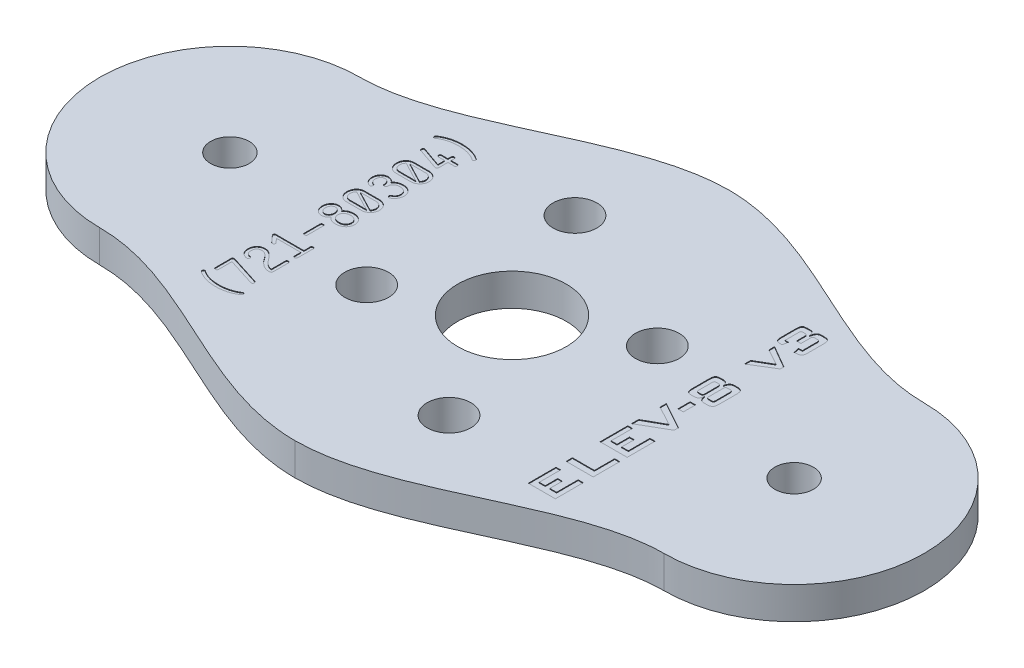
from build123d import *

# Parameters (mm, degrees)
SKETCH1_R                   = 3.96875
BOSS_EXTRUDE1_DEPTH         = 2.3622
M3_CLEARANCE_HOLE1_D        = 3.2
F_32_0_116_DIAMETER_HOLE1_D = 2.8194
SKETCH8_W                   = 0.394335731
SKETCH8_H                   = 0.891686135
RASTER_TEXT_DEPTH           = 0.05


with BuildPart() as part:
    # Sketch1 → Boss-Extrude1 (new body)
    with BuildSketch(Plane(origin=(0, 0, 0), x_dir=(1, 0, 0), z_dir=(0, 1, 0))):
        with BuildLine():
            ThreePointArc((20.6375, -9.525), (30.1625, 0), (20.6375, 9.525))
            add(Edge.make_bspline(
                [(20.6375, 9.525), (14.092069819, 9.525), (6.925269284, 15.875), (0, 15.875)],
                knots=[0, 0, 0, 0, 1, 1, 1, 1], degree=3))
            add(Edge.make_bspline(
                [(-20.6375, 9.525), (-14.092069819, 9.525), (-6.925269284, 15.875), (0, 15.875)],
                knots=[0, 0, 0, 0, 1, 1, 1, 1], degree=3))
            ThreePointArc((-20.6375, 9.525), (-30.1625, 0), (-20.6375, -9.525))
            add(Edge.make_bspline(
                [(-20.6375, -9.525), (-14.092069819, -9.525), (-6.925269284, -15.875), (0, -15.875)],
                knots=[0, 0, 0, 0, 1, 1, 1, 1], degree=3))
            add(Edge.make_bspline(
                [(20.6375, -9.525), (14.092069819, -9.525), (6.925269284, -15.875), (0, -15.875)],
                knots=[0, 0, 0, 0, 1, 1, 1, 1], degree=3))
        make_face()
        with Locations(Location((0, 0, 0), (0, 0, 270))):
            Circle(SKETCH1_R, mode=Mode.SUBTRACT)
    extrude(amount=BOSS_EXTRUDE1_DEPTH)

    # M3 Clearance Hole1 (through all)
    with Locations(Plane(origin=(33.3375, 0, 0), x_dir=(-1, 0, 0), z_dir=(0, -1, 0))):
        with Locations((37.362938943, 8.632581672), (40.587962296, -3.380946094), (29.312061057, -8.632581672), (26.087037704, 3.380946094)):
            Hole(M3_CLEARANCE_HOLE1_D / 2)

    # #32 (0.116) Diameter Hole1 (through all)
    with Locations(Plane(origin=(0, 0, 0), x_dir=(-1, 0, 0), z_dir=(0, -1, 0))):
        with Locations((-20.6375, 0), (20.6375, 0)):
            Hole(F_32_0_116_DIAMETER_HOLE1_D / 2)

    # Sketch8 → Raster Text (cut)
    # profile 1 of 19: a face of its own
    with BuildSketch(Plane(origin=(0, 2.3622, 0), x_dir=(1, 0, 0), z_dir=(0, 1, 0))):
        with BuildLine():
            add(Edge.make_bspline(
                [(-14.012482394, -8.418221831), (-13.965085448, -8.447858031), (-13.870171942, -8.507205222), (-13.718746303, -8.58186166), (-13.560857258, -8.645300125), (-13.39602453, -8.697401696), (-13.224483709, -8.737577583), (-13.046055939, -8.766282014), (-12.860820439, -8.783963585), (-12.734905947, -8.786075099), (-12.670933099, -8.787147887)],
                knots=[0, 0, 0, 0, 0.95005714, 1.902511912, 2.866128646, 3.841250136, 4.839124721, 5.859245033, 6.912355599, 8, 8, 8, 8], degree=3))
            add(Edge.make_bspline(
                [(-12.670933099, -8.787147887), (-12.60696025, -8.786075099), (-12.481045758, -8.783963585), (-12.295810258, -8.766282014), (-12.117382488, -8.737577583), (-11.945841667, -8.697401696), (-11.78100894, -8.645300125), (-11.623119894, -8.58186166), (-11.471694255, -8.507205222), (-11.376780749, -8.447858031), (-11.329383803, -8.418221831)],
                knots=[0, 0, 0, 0, 1.087644401, 2.140754967, 3.160875279, 4.158749864, 5.133871354, 6.097488088, 7.04994286, 8, 8, 8, 8], degree=3))
            add(Edge.make_bspline(
                [(-11.329383803, -8.418221831), (-11.324143654, -8.413111766), (-11.314169804, -8.403385511), (-11.29718998, -8.392881765), (-11.279948895, -8.385900684), (-11.268132595, -8.385085193), (-11.262306338, -8.384683099)],
                knots=[0, 0, 0, 0, 1.137252894, 2.164593206, 3.095016889, 4, 4, 4, 4], degree=3))
            add(Edge.make_bspline(
                [(-11.262306338, -8.384683099), (-11.255623164, -8.385101392), (-11.242523036, -8.385921315), (-11.22377932, -8.391960177), (-11.206434404, -8.401688051), (-11.191278919, -8.415187), (-11.178238911, -8.430641296), (-11.168270989, -8.447710073), (-11.163202263, -8.46633093), (-11.162193352, -8.478986906), (-11.161690141, -8.485299296)],
                knots=[0, 0, 0, 0, 1.01995096, 1.999272694, 2.979321738, 4.039016944, 5.081425062, 6.061474106, 7.033126225, 8, 8, 8, 8], degree=3))
            add(Edge.make_bspline(
                [(-11.161690141, -8.485299296), (-11.162049163, -8.494950041), (-11.162742954, -8.51359956), (-11.1693603, -8.540313982), (-11.179587854, -8.564900493), (-11.190033025, -8.578934442), (-11.195228873, -8.585915493)],
                knots=[0, 0, 0, 0, 1.06884328, 2.065479224, 3.037691587, 4, 4, 4, 4], degree=3))
            add(Edge.make_bspline(
                [(-11.195228873, -8.585915493), (-11.221275697, -8.603795625), (-11.273187101, -8.639430788), (-11.353797316, -8.688620744), (-11.435853718, -8.734793239), (-11.520041049, -8.777266321), (-11.60579272, -8.816622314), (-11.693647914, -8.852231683), (-11.783072651, -8.884809199), (-11.874591902, -8.913545169), (-11.96769239, -8.939345515), (-12.062866055, -8.961210559), (-12.159646268, -8.980232287), (-12.258465876, -8.995229624), (-12.358929287, -9.007478439), (-12.461388384, -9.015582549), (-12.565537856, -9.021179133), (-12.635639977, -9.021671254), (-12.670933099, -9.021919014)],
                knots=[0, 0, 0, 0, 0.969564449, 1.932345106, 2.897332748, 3.858858539, 4.825750861, 5.792524251, 6.767764766, 7.746183599, 8.736052808, 9.732290593, 10.74279627, 11.762702993, 12.799494237, 13.848523982, 14.916832987, 16, 16, 16, 16], degree=3))
            add(Edge.make_bspline(
                [(-12.670933099, -9.021919014), (-12.70622622, -9.021671254), (-12.776328341, -9.021179133), (-12.880477813, -9.015582549), (-12.98293691, -9.007478439), (-13.083400321, -8.995229624), (-13.182219929, -8.980232287), (-13.279000142, -8.961210559), (-13.374173807, -8.939345515), (-13.467274295, -8.913545169), (-13.558793546, -8.884809199), (-13.648218283, -8.852231683), (-13.736073477, -8.816622314), (-13.821825149, -8.777266321), (-13.906012479, -8.734793239), (-13.988068881, -8.688620744), (-14.068679096, -8.639430788), (-14.1205905, -8.603795625), (-14.146637324, -8.585915493)],
                knots=[0, 0, 0, 0, 1.083167013, 2.151476018, 3.200505763, 4.237297007, 5.25720373, 6.267709407, 7.263947192, 8.253816401, 9.232235234, 10.207475749, 11.174249139, 12.141141461, 13.102667252, 14.067654894, 15.030435551, 16, 16, 16, 16], degree=3))
            add(Edge.make_bspline(
                [(-14.146637324, -8.585915493), (-14.151833172, -8.578934442), (-14.162278343, -8.564900493), (-14.172505898, -8.540313982), (-14.179123243, -8.51359956), (-14.179817034, -8.494950041), (-14.180176056, -8.485299296)],
                knots=[0, 0, 0, 0, 0.962308413, 1.934520776, 2.93115672, 4, 4, 4, 4], degree=3))
            add(Edge.make_bspline(
                [(-14.180176056, -8.485299296), (-14.179672845, -8.478986906), (-14.178663935, -8.46633093), (-14.173595208, -8.447710073), (-14.163627286, -8.430641296), (-14.150587278, -8.415187), (-14.135431794, -8.401688051), (-14.118086877, -8.391960177), (-14.099343162, -8.385921315), (-14.086243034, -8.385101392), (-14.079559859, -8.384683099)],
                knots=[0, 0, 0, 0, 0.966873775, 1.938525894, 2.918574938, 3.960983056, 5.020678262, 6.000727306, 6.98004904, 8, 8, 8, 8], degree=3))
            add(Edge.make_bspline(
                [(-14.079559859, -8.384683099), (-14.073745315, -8.385113735), (-14.061788683, -8.385999267), (-14.044357067, -8.392598974), (-14.027648976, -8.403589365), (-14.017742826, -8.413146653), (-14.012482394, -8.418221831)],
                knots=[0, 0, 0, 0, 0.904405149, 1.859757168, 2.863473405, 4, 4, 4, 4], degree=3))
        make_face()
    # profile 2 of 19: a face of its own
    with BuildSketch(Plane(origin=(0, 2.3622, 0), x_dir=(1, 0, 0), z_dir=(0, 1, 0))):
        with BuildLine():
            Line((-13.695436565, -6.572019421), (-13.691768266, -6.573591549))
            Line((-13.691768266, -6.573591549), (-13.576478873, -6.607130282))
            Line((-13.576478873, -6.607130282), (-11.56415493, -7.244366197))
            add(Edge.make_bspline(
                [(-11.56415493, -7.244366197), (-11.551950717, -7.249324252), (-11.528885164, -7.258694809), (-11.502713834, -7.285325646), (-11.486308784, -7.319223808), (-11.485127782, -7.344602469), (-11.48450044, -7.358083462)],
                knots=[0, 0, 0, 0, 1.047388012, 1.97952813, 2.926737498, 4, 4, 4, 4], degree=3))
            add(Edge.make_bspline(
                [(-11.48450044, -7.358083462), (-11.484714782, -7.36806868), (-11.485120601, -7.386973976), (-11.490410871, -7.413309183), (-11.498616919, -7.435815388), (-11.510441327, -7.454419145), (-11.526012868, -7.469052443), (-11.545446583, -7.479044743), (-11.568024905, -7.484779483), (-11.584033702, -7.485546487), (-11.592453235, -7.485949879)],
                knots=[0, 0, 0, 0, 1.249596518, 2.365896559, 3.349839583, 4.236416032, 5.103865316, 5.995024979, 6.945520214, 8, 8, 8, 8], degree=3))
            add(Edge.make_bspline(
                [(-11.592453235, -7.485949879), (-11.598966462, -7.485713118), (-11.612204538, -7.485231905), (-11.624822539, -7.481190387), (-11.631232394, -7.479137324)],
                knots=[0, 0, 0, 0, 0.984014181, 2, 2, 2, 2], degree=3))
            Line((-11.631232394, -7.479137324), (-13.643556338, -6.841901408))
            Line((-13.643556338, -6.841901408), (-13.643556338, -7.818192947))
            add(Edge.make_bspline(
                [(-13.643556338, -7.818192947), (-13.643672127, -7.827160188), (-13.643888511, -7.843918044), (-13.650341608, -7.867102486), (-13.65853055, -7.887620925), (-13.672532624, -7.903509262), (-13.688993538, -7.916988993), (-13.710218758, -7.924565645), (-13.734175832, -7.93107264), (-13.751624376, -7.931277026), (-13.760941901, -7.931386169)],
                knots=[0, 0, 0, 0, 1.145082073, 2.139913451, 3.072986495, 3.948275118, 4.827000752, 5.771844678, 6.810164681, 8, 8, 8, 8], degree=3))
            add(Edge.make_bspline(
                [(-13.760941901, -7.931386169), (-13.770070827, -7.931230019), (-13.787489243, -7.93093208), (-13.811430598, -7.924825443), (-13.832473279, -7.916637207), (-13.849414655, -7.903904005), (-13.862589753, -7.887258749), (-13.871906092, -7.867366651), (-13.877097386, -7.843774524), (-13.877897816, -7.827128223), (-13.878327465, -7.818192947)],
                knots=[0, 0, 0, 0, 1.169218269, 2.230922842, 3.156462765, 4.054368379, 4.91677856, 5.860647785, 6.851654542, 8, 8, 8, 8], degree=3))
            Line((-13.878327465, -7.818192947), (-13.878327465, -6.841901408))
            Line((-13.878327465, -6.841901408), (-13.878327465, -6.67682796))
            add(Edge.make_bspline(
                [(-13.878327465, -6.67682796), (-13.877963652, -6.667525729), (-13.877282749, -6.650115889), (-13.871268791, -6.625852686), (-13.862230521, -6.604795429), (-13.847764067, -6.588168121), (-13.83032984, -6.574577367), (-13.808345814, -6.565921712), (-13.78310532, -6.559894367), (-13.764827632, -6.55959857), (-13.755177432, -6.559442397)],
                knots=[0, 0, 0, 0, 1.142786369, 2.138812389, 3.062348774, 3.932270476, 4.822416454, 5.756900313, 6.815694862, 8, 8, 8, 8], degree=3))
            add(Edge.make_bspline(
                [(-13.755177432, -6.559442397), (-13.744570997, -6.559903339), (-13.723952352, -6.5607994), (-13.70475743, -6.568351968), (-13.695436565, -6.572019421)],
                knots=[0, 0, 0, 0, 1.028819729, 2, 2, 2, 2], degree=3))
        make_face()
    # profile 3 of 19: a face of its own
    with BuildSketch(Plane(origin=(0, 2.3622, 0), x_dir=(1, 0, 0), z_dir=(0, 1, 0))):
        with BuildLine():
            Line((-11.497077465, -4.850539173), (-11.497077465, -5.869278169))
            Line((-11.497077465, -5.869278169), (-11.497077465, -5.986663732))
            add(Edge.make_bspline(
                [(-11.497077465, -5.986663732), (-11.497460498, -5.994395887), (-11.498213894, -6.009604434), (-11.504814142, -6.031527092), (-11.515484805, -6.051829003), (-11.530090182, -6.069715101), (-11.547067101, -6.085322816), (-11.566957317, -6.095467442), (-11.587878611, -6.103160343), (-11.602685109, -6.103748152), (-11.610270687, -6.104049296)],
                knots=[0, 0, 0, 0, 1.024640835, 2.015388796, 3.011280722, 4.050774086, 5.069624456, 6.04505347, 6.998453377, 8, 8, 8, 8], degree=3))
            Line((-11.610270687, -6.104049296), (-11.722939866, -6.104049296))
            add(Edge.make_bspline(
                [(-11.722939866, -6.104049296), (-11.744292543, -6.103485917), (-11.78740195, -6.102348499), (-11.852250151, -6.091594691), (-11.917803752, -6.075684764), (-11.983688604, -6.05202433), (-12.050359408, -6.022518148), (-12.117988289, -5.986985461), (-12.185954499, -5.94415313), (-12.230064863, -5.911663093), (-12.252747029, -5.894956261)],
                knots=[0, 0, 0, 0, 0.88345208, 1.783621582, 2.71509275, 3.673551017, 4.677434001, 5.732139668, 6.833834462, 8, 8, 8, 8], degree=3))
            add(Edge.make_bspline(
                [(-12.252747029, -5.894956261), (-12.290915294, -5.864737519), (-12.367171766, -5.804363418), (-12.470729932, -5.701069049), (-12.566767091, -5.589447917), (-12.622086287, -5.50791314), (-12.649971391, -5.46681338)],
                knots=[0, 0, 0, 0, 0.994575443, 1.987064751, 2.985326759, 4, 4, 4, 4], degree=3))
            add(Edge.make_bspline(
                [(-12.649971391, -5.46681338), (-12.662269603, -5.447923029), (-12.687347198, -5.409403237), (-12.731154643, -5.35412715), (-12.77834581, -5.297536366), (-12.813719072, -5.261834449), (-12.831814206, -5.243571193)],
                knots=[0, 0, 0, 0, 0.937014434, 1.910689735, 2.931216807, 4, 4, 4, 4], degree=3))
            add(Edge.make_bspline(
                [(-12.831814206, -5.243571193), (-12.849442755, -5.226775483), (-12.883604712, -5.194227468), (-12.936328441, -5.15023078), (-12.989752001, -5.114462972), (-13.041401044, -5.083099393), (-13.093740449, -5.060224741), (-13.14537712, -5.043012812), (-13.196829263, -5.032633443), (-13.231091097, -5.031410153), (-13.247904104, -5.030809859)],
                knots=[0, 0, 0, 0, 1.219203367, 2.362665957, 3.432572281, 4.436173918, 5.383783583, 6.285513964, 7.158665416, 8, 8, 8, 8], degree=3))
            add(Edge.make_bspline(
                [(-13.247904104, -5.030809859), (-13.263118595, -5.031045984), (-13.292770839, -5.031506178), (-13.335880523, -5.036981415), (-13.376381856, -5.045291635), (-13.414458004, -5.056639021), (-13.449754668, -5.07217219), (-13.482807423, -5.090248529), (-13.513082306, -5.112049753), (-13.540420545, -5.137173457), (-13.564235283, -5.165771694), (-13.586285546, -5.196132483), (-13.604021046, -5.229905662), (-13.617990665, -5.266463242), (-13.629639968, -5.305303785), (-13.638052536, -5.346848449), (-13.642678562, -5.391069815), (-13.643258654, -5.421385789), (-13.643556338, -5.436942947)],
                knots=[0, 0, 0, 0, 1.132827701, 2.207821773, 3.231247692, 4.21096658, 5.161024679, 6.09888364, 7.012597094, 7.933510341, 8.856627611, 9.780936533, 10.724017367, 11.688229811, 12.692868016, 13.741789531, 14.841160864, 16, 16, 16, 16], degree=3))
            add(Edge.make_bspline(
                [(-13.643556338, -5.436942947), (-13.642641264, -5.465148727), (-13.640904033, -5.518696308), (-13.62551471, -5.594219585), (-13.600906028, -5.660450047), (-13.564311519, -5.716575186), (-13.517311593, -5.762362846), (-13.460206927, -5.798152035), (-13.392845742, -5.823603387), (-13.343839717, -5.831562972), (-13.318125825, -5.835739437)],
                knots=[0, 0, 0, 0, 1.177882614, 2.236164502, 3.207079367, 4.114406019, 5.012874731, 5.92853706, 6.913085208, 8, 8, 8, 8], degree=3))
            add(Edge.make_bspline(
                [(-13.318125825, -5.835739437), (-13.310410715, -5.837330114), (-13.295610627, -5.840381548), (-13.274820462, -5.847238415), (-13.257715986, -5.858309094), (-13.242934938, -5.871270325), (-13.232756931, -5.888158942), (-13.224464215, -5.906887629), (-13.219904483, -5.928634865), (-13.219364423, -5.944022864), (-13.219081756, -5.952076915)],
                knots=[0, 0, 0, 0, 1.113657657, 2.136356979, 3.067717479, 3.975897937, 4.886422955, 5.826247583, 6.862261937, 8, 8, 8, 8], degree=3))
            add(Edge.make_bspline(
                [(-13.219081756, -5.952076915), (-13.219464254, -5.960499753), (-13.220208926, -5.976897876), (-13.226681532, -6.000704409), (-13.238092479, -6.022373797), (-13.2528489, -6.042187455), (-13.271691233, -6.058218264), (-13.294161695, -6.068387528), (-13.319537774, -6.073499654), (-13.337157644, -6.071540765), (-13.346424131, -6.070510563)],
                knots=[0, 0, 0, 0, 1.012353267, 1.970914286, 2.939104718, 3.94379268, 4.928720182, 5.878484753, 6.884271335, 8, 8, 8, 8], degree=3))
            add(Edge.make_bspline(
                [(-13.346424131, -6.070510563), (-13.36622606, -6.067528766), (-13.404931022, -6.061700527), (-13.461098095, -6.04736806), (-13.514137451, -6.02834971), (-13.564463208, -6.005522586), (-13.61167473, -5.977919471), (-13.655648796, -5.945882762), (-13.696922144, -5.909577303), (-13.734231861, -5.86867154), (-13.768563113, -5.824829071), (-13.797899701, -5.777480782), (-13.822521759, -5.727358207), (-13.843182039, -5.674854185), (-13.85871532, -5.619492002), (-13.870393687, -5.56154716), (-13.877275311, -5.500694262), (-13.877972505, -5.45914488), (-13.878327465, -5.437991032)],
                knots=[0, 0, 0, 0, 1.054460814, 2.061055037, 3.047766896, 4.019561454, 4.968116528, 5.923432466, 6.88175756, 7.858593211, 8.835992192, 9.811439798, 10.786800586, 11.774541789, 12.779452039, 13.811755627, 14.885909102, 16, 16, 16, 16], degree=3))
            add(Edge.make_bspline(
                [(-13.878327465, -5.437991032), (-13.877825607, -5.414565218), (-13.876841418, -5.368625049), (-13.869089768, -5.301379088), (-13.855183196, -5.237856486), (-13.837217512, -5.177574167), (-13.812688882, -5.121208053), (-13.783449073, -5.068031858), (-13.748428634, -5.018510651), (-13.708904348, -4.97236192), (-13.664308272, -4.931267016), (-13.616602251, -4.894767639), (-13.565064261, -4.864092811), (-13.510186167, -4.838762073), (-13.45137669, -4.820306555), (-13.389805382, -4.805809124), (-13.324474469, -4.797360268), (-13.27972011, -4.796486147), (-13.25681283, -4.796038732)],
                knots=[0, 0, 0, 0, 1.117051885, 2.190641168, 3.221628387, 4.215045171, 5.185278802, 6.147324054, 7.104125332, 8.072748318, 9.039434989, 9.990781047, 10.932264911, 11.894021586, 12.866113082, 13.866386979, 14.907921571, 16, 16, 16, 16], degree=3))
            add(Edge.make_bspline(
                [(-13.25681283, -4.796038732), (-13.239850194, -4.796447013), (-13.205810125, -4.797266336), (-13.154974032, -4.803773189), (-13.104350995, -4.814330394), (-13.054041596, -4.828994132), (-13.003997959, -4.848065412), (-12.954128727, -4.871242354), (-12.904350537, -4.898455891), (-12.854952119, -4.930174584), (-12.805654499, -4.965912605), (-12.756428643, -5.005710548), (-12.707622225, -5.049802336), (-12.659465641, -5.09849886), (-12.610599824, -5.150393696), (-12.563120562, -5.207689188), (-12.514660606, -5.268060962), (-12.483835124, -5.310854039), (-12.468128576, -5.332658451)],
                knots=[0, 0, 0, 0, 0.82144355, 1.648446261, 2.478171445, 3.324301349, 4.183904371, 5.069758336, 5.986121319, 6.929698439, 7.911355002, 8.934157726, 9.994524265, 11.095403981, 12.25089033, 13.445852247, 14.69858179, 16, 16, 16, 16], degree=3))
            add(Edge.make_bspline(
                [(-12.468128576, -5.332658451), (-12.465501905, -5.336322153), (-12.458639363, -5.345894079), (-12.446118646, -5.363876349), (-12.428312238, -5.388089577), (-12.415164181, -5.406697304), (-12.407863666, -5.417029324)],
                knots=[0, 0, 0, 0, 0.521734408, 1.363103023, 2.535851556, 4, 4, 4, 4], degree=3))
            add(Edge.make_bspline(
                [(-12.407863666, -5.417029324), (-12.379138159, -5.452695591), (-12.323971723, -5.521191535), (-12.237578507, -5.613592962), (-12.152028188, -5.692294916), (-12.066371106, -5.755674259), (-11.982383115, -5.806940996), (-11.898219397, -5.842038776), (-11.815041517, -5.865469231), (-11.759245609, -5.868023813), (-11.731848592, -5.869278169)],
                knots=[0, 0, 0, 0, 1.30725296, 2.510538272, 3.608667223, 4.621189762, 5.549297264, 6.409880356, 7.219216287, 8, 8, 8, 8], degree=3))
            Line((-11.731848592, -5.869278169), (-11.731848592, -4.850539173))
            add(Edge.make_bspline(
                [(-11.731848592, -4.850539173), (-11.731389807, -4.841613062), (-11.730526358, -4.824813788), (-11.725654635, -4.801098782), (-11.715942374, -4.781391173), (-11.702972686, -4.764771342), (-11.685855795, -4.752249951), (-11.665171926, -4.743076326), (-11.640904112, -4.738042926), (-11.623568792, -4.737585975), (-11.614463028, -4.737345951)],
                knots=[0, 0, 0, 0, 1.14754433, 2.159721406, 3.082709479, 3.944518011, 4.841797213, 5.775625213, 6.831597421, 8, 8, 8, 8], degree=3))
            add(Edge.make_bspline(
                [(-11.614463028, -4.737345951), (-11.605169643, -4.737542452), (-11.587806083, -4.73790959), (-11.563522692, -4.743335764), (-11.542646956, -4.751892588), (-11.526018186, -4.765167082), (-11.51222594, -4.7810294), (-11.503634624, -4.801366533), (-11.497500418, -4.824671473), (-11.497223929, -4.841581477), (-11.497077465, -4.850539173)],
                knots=[0, 0, 0, 0, 1.189098685, 2.221686205, 3.174672581, 4.052854191, 4.927600919, 5.839695063, 6.855626854, 8, 8, 8, 8], degree=3))
        make_face()
    # profile 4 of 19: a face of its own
    with BuildSketch(Plane(origin=(0, 2.3622, 0), x_dir=(1, 0, 0), z_dir=(0, 1, 0))):
        with BuildLine():
            Line((-13.72949934, -3.508989877), (-11.712983055, -3.508989877))
            Line((-11.712983055, -3.508989877), (-11.712983055, -3.056216989))
            add(Edge.make_bspline(
                [(-11.712983055, -3.056216989), (-11.712851943, -3.047253379), (-11.712604434, -3.03033221), (-11.706296807, -3.0071703), (-11.698414772, -2.986757486), (-11.68511146, -2.970875205), (-11.669026889, -2.957570129), (-11.648801274, -2.949106639), (-11.625418232, -2.943560364), (-11.608737849, -2.943211117), (-11.599789833, -2.943023768)],
                knots=[0, 0, 0, 0, 1.166209758, 2.201527278, 3.121729124, 3.998729129, 4.875729135, 5.826018128, 6.833790242, 8, 8, 8, 8], degree=3))
            add(Edge.make_bspline(
                [(-11.599789833, -2.943023768), (-11.590850639, -2.943240308), (-11.574016175, -2.943648101), (-11.550518312, -2.948884825), (-11.530468379, -2.957739581), (-11.514411639, -2.970838795), (-11.501312424, -2.986895536), (-11.492457668, -3.006945468), (-11.487220945, -3.030443331), (-11.486813151, -3.047277795), (-11.486596611, -3.056216989)],
                knots=[0, 0, 0, 0, 1.16541512, 2.194732443, 3.123597569, 4, 4.876402431, 5.805267557, 6.83458488, 8, 8, 8, 8], degree=3))
            Line((-11.486596611, -3.056216989), (-11.486596611, -4.188149208))
            add(Edge.make_bspline(
                [(-11.486596611, -4.188149208), (-11.486783961, -4.197097224), (-11.487133207, -4.213777607), (-11.492679482, -4.237160649), (-11.501142972, -4.257386264), (-11.514448049, -4.273470835), (-11.53033033, -4.286774147), (-11.550743143, -4.294656182), (-11.573905053, -4.300963809), (-11.590826222, -4.301211318), (-11.599789833, -4.30134243)],
                knots=[0, 0, 0, 0, 1.166209758, 2.173981872, 3.124270865, 4.001270871, 4.878270876, 5.798472722, 6.833790242, 8, 8, 8, 8], degree=3))
            add(Edge.make_bspline(
                [(-11.599789833, -4.30134243), (-11.608762639, -4.301241674), (-11.625530895, -4.301053384), (-11.648579397, -4.294433734), (-11.669161606, -4.286944147), (-11.685076202, -4.273435577), (-11.698584772, -4.257520981), (-11.706074359, -4.236938772), (-11.712694009, -4.21389027), (-11.712882299, -4.197122014), (-11.712983055, -4.188149208)],
                knots=[0, 0, 0, 0, 1.16691156, 2.180708094, 3.122472233, 4, 4.877527767, 5.819291906, 6.83308844, 8, 8, 8, 8], degree=3))
            Line((-11.712983055, -4.188149208), (-11.712983055, -3.73537632))
            Line((-11.712983055, -3.73537632), (-13.495776298, -3.73537632))
            Line((-13.495776298, -3.73537632), (-13.232182824, -4.027268101))
            add(Edge.make_bspline(
                [(-13.232182824, -4.027268101), (-13.223406964, -4.039008622), (-13.206480895, -4.061652657), (-13.203667224, -4.089733065), (-13.20231239, -4.103254291)],
                knots=[0, 0, 0, 0, 1.036963721, 2, 2, 2, 2], degree=3))
            add(Edge.make_bspline(
                [(-13.20231239, -4.103254291), (-13.202618487, -4.110836955), (-13.203215967, -4.125637765), (-13.210920356, -4.146825606), (-13.221612464, -4.166961357), (-13.237467099, -4.184381509), (-13.255652793, -4.198820878), (-13.275166249, -4.210407332), (-13.296770985, -4.216843314), (-13.311623253, -4.217623173), (-13.319173911, -4.218019641)],
                knots=[0, 0, 0, 0, 1.000339787, 1.952590874, 2.95828011, 4.008595381, 5.046836185, 6.032315271, 6.999660213, 8, 8, 8, 8], degree=3))
            add(Edge.make_bspline(
                [(-13.319173911, -4.218019641), (-13.326576689, -4.217488174), (-13.341396714, -4.2164242), (-13.362777763, -4.208534179), (-13.38309694, -4.196464843), (-13.394508203, -4.185105828), (-13.400400528, -4.179240482)],
                knots=[0, 0, 0, 0, 0.958465335, 1.918803982, 2.92535266, 4, 4, 4, 4], degree=3))
            Line((-13.400400528, -4.179240482), (-13.819634683, -3.71389057))
            add(Edge.make_bspline(
                [(-13.819634683, -3.71389057), (-13.826514205, -3.707752436), (-13.84105994, -3.694774255), (-13.850022106, -3.677436553), (-13.854745544, -3.668298856)],
                knots=[0, 0, 0, 0, 0.9459159, 2, 2, 2, 2], degree=3))
            add(Edge.make_bspline(
                [(-13.854745544, -3.668298856), (-13.857731441, -3.660887975), (-13.863620756, -3.64627093), (-13.866041625, -3.622698329), (-13.863489283, -3.598847119), (-13.857726122, -3.583832545), (-13.854745544, -3.576067342)],
                knots=[0, 0, 0, 0, 1.003431973, 1.979145567, 2.954859161, 4, 4, 4, 4], degree=3))
            add(Edge.make_bspline(
                [(-13.854745544, -3.576067342), (-13.851105588, -3.568476584), (-13.844075541, -3.553816134), (-13.827413756, -3.536326079), (-13.808545668, -3.521944673), (-13.793629225, -3.516818954), (-13.786095951, -3.514230304)],
                knots=[0, 0, 0, 0, 1.051264243, 2.030364709, 3.005272006, 4, 4, 4, 4], degree=3))
            add(Edge.make_bspline(
                [(-13.786095951, -3.514230304), (-13.776027609, -3.511174547), (-13.757474567, -3.505543672), (-13.738278231, -3.507908425), (-13.72949934, -3.508989877)],
                knots=[0, 0, 0, 0, 1.085357562, 2, 2, 2, 2], degree=3))
        make_face()
    # profile 5 of 19: a face of its own
    with BuildSketch(Plane(origin=(0, 2.3622, 0), x_dir=(1, 0, 0), z_dir=(0, 1, 0))):
        with BuildLine():
            Line((-12.805088028, -2.377057658), (-12.805088028, -1.24512544))
            add(Edge.make_bspline(
                [(-12.805088028, -1.24512544), (-12.804629244, -1.23619933), (-12.803765794, -1.219400056), (-12.798894072, -1.19568505), (-12.789181811, -1.17597744), (-12.776212123, -1.15935761), (-12.759095232, -1.146836219), (-12.738411363, -1.137662593), (-12.714143549, -1.132629194), (-12.696808229, -1.132172242), (-12.687702465, -1.131932218)],
                knots=[0, 0, 0, 0, 1.14754433, 2.159721406, 3.082709479, 3.944518011, 4.841797213, 5.775625213, 6.831597421, 8, 8, 8, 8], degree=3))
            add(Edge.make_bspline(
                [(-12.687702465, -1.131932218), (-12.678409079, -1.132128719), (-12.661045519, -1.132495857), (-12.636762128, -1.137922032), (-12.615886393, -1.146478856), (-12.599257622, -1.159753349), (-12.585465376, -1.175615668), (-12.576874061, -1.195952801), (-12.570739855, -1.219257741), (-12.570463365, -1.236167745), (-12.570316901, -1.24512544)],
                knots=[0, 0, 0, 0, 1.189098685, 2.221686205, 3.174672581, 4.052854191, 4.927600919, 5.839695063, 6.855626854, 8, 8, 8, 8], degree=3))
            Line((-12.570316901, -1.24512544), (-12.570316901, -2.377057658))
            add(Edge.make_bspline(
                [(-12.570316901, -2.377057658), (-12.57043269, -2.3860249), (-12.570649074, -2.402782756), (-12.577102172, -2.425967197), (-12.585291113, -2.446485637), (-12.599293187, -2.462373973), (-12.615754101, -2.475853705), (-12.636979322, -2.483430357), (-12.660936395, -2.489937351), (-12.678384939, -2.490141738), (-12.687702465, -2.49025088)],
                knots=[0, 0, 0, 0, 1.145082073, 2.139913451, 3.072986495, 3.948275118, 4.827000752, 5.771844678, 6.810164681, 8, 8, 8, 8], degree=3))
            add(Edge.make_bspline(
                [(-12.687702465, -2.49025088), (-12.696831391, -2.490094731), (-12.714249806, -2.489796791), (-12.738191161, -2.483690154), (-12.759233842, -2.475501919), (-12.776175218, -2.462768717), (-12.789350316, -2.446123461), (-12.798666655, -2.426231363), (-12.803857949, -2.402639236), (-12.804658379, -2.385992935), (-12.805088028, -2.377057658)],
                knots=[0, 0, 0, 0, 1.169218269, 2.230922842, 3.156462765, 4.054368379, 4.91677856, 5.860647785, 6.851654542, 8, 8, 8, 8], degree=3))
        make_face()
    # profile 6 of 19: a face of its own
    with BuildSketch(Plane(origin=(0, 2.3622, 0), x_dir=(1, 0, 0), z_dir=(0, 1, 0))):
        with BuildLine():
            add(Edge.make_bspline(
                [(-12.233881492, -0.670774648), (-12.267465896, -0.670066028), (-12.332637251, -0.668690933), (-12.42731757, -0.655282001), (-12.515526685, -0.63344014), (-12.59755434, -0.603164997), (-12.672838709, -0.563320224), (-12.741668036, -0.514937409), (-12.804601179, -0.457978372), (-12.840067796, -0.413811409), (-12.85801634, -0.391459892)],
                knots=[0, 0, 0, 0, 1.133647608, 2.19987089, 3.22145454, 4.197765738, 5.145130952, 6.089479071, 7.03314517, 8, 8, 8, 8], degree=3))
            add(Edge.make_bspline(
                [(-12.85801634, -0.391459892), (-12.872208714, -0.411070842), (-12.899961882, -0.449420027), (-12.948859568, -0.499106392), (-13.000202111, -0.542037421), (-13.055339992, -0.577309334), (-13.11445684, -0.603867281), (-13.176828216, -0.623541031), (-13.242914998, -0.63534765), (-13.288207115, -0.636598026), (-13.31131327, -0.637235915)],
                knots=[0, 0, 0, 0, 1.078337729, 2.108687965, 3.099269529, 4.058943694, 5.017763563, 5.981256933, 6.970121185, 8, 8, 8, 8], degree=3))
            add(Edge.make_bspline(
                [(-13.31131327, -0.637235915), (-13.330040578, -0.636803016), (-13.366991428, -0.635948862), (-13.421372757, -0.62701714), (-13.474026848, -0.613696708), (-13.524520131, -0.594007958), (-13.572984224, -0.569261359), (-13.619431349, -0.539184142), (-13.663817, -0.503276046), (-13.690977653, -0.475756734), (-13.704869333, -0.461681613)],
                knots=[0, 0, 0, 0, 1.011802692, 1.996387823, 2.972371806, 3.944187345, 4.92003419, 5.910402013, 6.931247068, 8, 8, 8, 8], degree=3))
            add(Edge.make_bspline(
                [(-13.704869333, -0.461681613), (-13.718841075, -0.446065426), (-13.746459819, -0.415196014), (-13.781632156, -0.364205117), (-13.81169128, -0.310787091), (-13.835881634, -0.254151452), (-13.854825649, -0.194657609), (-13.868242003, -0.132181141), (-13.877033109, -0.066977598), (-13.877891432, -0.022562912), (-13.878327465, 0)],
                knots=[0, 0, 0, 0, 0.993850546, 1.96460141, 2.933508894, 3.899288799, 4.882706755, 5.89275313, 6.929506698, 8, 8, 8, 8], degree=3))
            add(Edge.make_bspline(
                [(-13.878327465, 0), (-13.877891432, 0.022562912), (-13.877033109, 0.066977598), (-13.868242003, 0.132181141), (-13.854825649, 0.194657609), (-13.835881634, 0.254151452), (-13.81169128, 0.310787091), (-13.781632156, 0.364205117), (-13.746459819, 0.415196014), (-13.718841075, 0.446065426), (-13.704869333, 0.461681613)],
                knots=[0, 0, 0, 0, 1.070493302, 2.10724687, 3.117293245, 4.100711201, 5.066491106, 6.03539859, 7.006149454, 8, 8, 8, 8], degree=3))
            add(Edge.make_bspline(
                [(-13.704869333, 0.461681613), (-13.690996721, 0.475779205), (-13.663777829, 0.503439518), (-13.618886454, 0.539191541), (-13.572035429, 0.569145765), (-13.523604195, 0.593890806), (-13.473369168, 0.613803032), (-13.420842023, 0.626999193), (-13.36664194, 0.635925103), (-13.329865869, 0.636796379), (-13.31131327, 0.637235915)],
                knots=[0, 0, 0, 0, 1.069146266, 2.097728602, 3.096405029, 4.072611016, 5.035973142, 6.012316317, 6.997263806, 8, 8, 8, 8], degree=3))
            add(Edge.make_bspline(
                [(-13.31131327, 0.637235915), (-13.288207115, 0.636598026), (-13.242914998, 0.63534765), (-13.176828216, 0.623541031), (-13.11445684, 0.603867281), (-13.055339992, 0.577309334), (-13.000202111, 0.542037421), (-12.948859568, 0.499106392), (-12.899961882, 0.449420027), (-12.872208714, 0.411070842), (-12.85801634, 0.391459892)],
                knots=[0, 0, 0, 0, 1.029878815, 2.018743067, 2.982236437, 3.941056306, 4.900730471, 5.891312035, 6.921662271, 8, 8, 8, 8], degree=3))
            add(Edge.make_bspline(
                [(-12.85801634, 0.391459892), (-12.840067796, 0.413811409), (-12.804601179, 0.457978372), (-12.741668036, 0.514937409), (-12.672838709, 0.563320224), (-12.59755434, 0.603164997), (-12.515526685, 0.63344014), (-12.42731757, 0.655282001), (-12.332637251, 0.668690933), (-12.267465896, 0.670066028), (-12.233881492, 0.670774648)],
                knots=[0, 0, 0, 0, 0.96685483, 1.910520929, 2.854869048, 3.802234262, 4.77854546, 5.80012911, 6.866352392, 8, 8, 8, 8], degree=3))
            add(Edge.make_bspline(
                [(-12.233881492, 0.670774648), (-12.208876909, 0.670333451), (-12.159768798, 0.669466957), (-12.087547689, 0.660785904), (-12.018233055, 0.646843965), (-11.95202774, 0.626727295), (-11.88872922, 0.601657651), (-11.828735795, 0.57053173), (-11.771777112, 0.533721773), (-11.736501984, 0.505322002), (-11.718747524, 0.491028004)],
                knots=[0, 0, 0, 0, 1.075760531, 2.112755356, 3.12570641, 4.115143532, 5.086826292, 6.051884097, 7.019486343, 8, 8, 8, 8], degree=3))
            add(Edge.make_bspline(
                [(-11.718747524, 0.491028004), (-11.701046032, 0.47518703), (-11.666057086, 0.443875602), (-11.621278524, 0.390432168), (-11.58250565, 0.33434275), (-11.551382691, 0.274184323), (-11.526617388, 0.210855953), (-11.509263674, 0.143663007), (-11.499355571, 0.072963943), (-11.497847439, 0.024660981), (-11.497077465, 0)],
                knots=[0, 0, 0, 0, 1.022217139, 2.020524538, 2.995323522, 3.95466154, 4.931549879, 5.919048106, 6.937574167, 8, 8, 8, 8], degree=3))
            add(Edge.make_bspline(
                [(-11.497077465, 0), (-11.497847439, -0.024660981), (-11.499355571, -0.072963943), (-11.509263674, -0.143663007), (-11.526617388, -0.210855953), (-11.551382691, -0.274184323), (-11.58250565, -0.33434275), (-11.621278524, -0.390432168), (-11.666057086, -0.443875602), (-11.701046032, -0.47518703), (-11.718747524, -0.491028004)],
                knots=[0, 0, 0, 0, 1.062425833, 2.080951894, 3.068450121, 4.04533846, 5.004676478, 5.979475462, 6.977782861, 8, 8, 8, 8], degree=3))
            add(Edge.make_bspline(
                [(-11.718747524, -0.491028004), (-11.736501984, -0.505322002), (-11.771777112, -0.533721773), (-11.828735795, -0.57053173), (-11.88872922, -0.601657651), (-11.95202774, -0.626727295), (-12.018233055, -0.646843965), (-12.087547689, -0.660785904), (-12.159768798, -0.669466957), (-12.208876909, -0.670333451), (-12.233881492, -0.670774648)],
                knots=[0, 0, 0, 0, 0.980513657, 1.948115903, 2.913173708, 3.884856468, 4.87429359, 5.887244644, 6.924239469, 8, 8, 8, 8], degree=3))
        make_face()
        with BuildLine():
            add(Edge.make_bspline(
                [(-12.97278169, 0), (-12.973026769, 0.014865741), (-12.97350988, 0.044169807), (-12.97899704, 0.086913639), (-12.987154146, 0.127695343), (-12.99938802, 0.166047609), (-13.014589455, 0.202385467), (-13.03299703, 0.23672799), (-13.055021204, 0.269012119), (-13.072469658, 0.28840966), (-13.081258528, 0.298180293)],
                knots=[0, 0, 0, 0, 1.096147609, 2.160779075, 3.174339491, 4.16074269, 5.12535176, 6.076784386, 7.031267182, 8, 8, 8, 8], degree=3))
            add(Edge.make_bspline(
                [(-13.081258528, 0.298180293), (-13.097609615, 0.314128368), (-13.129154641, 0.344895891), (-13.185277203, 0.377811079), (-13.245143295, 0.39929351), (-13.287024406, 0.401400851), (-13.308169014, 0.402464789)],
                knots=[0, 0, 0, 0, 1.063133606, 2.051030379, 3.016019448, 4, 4, 4, 4], degree=3))
            add(Edge.make_bspline(
                [(-13.308169014, 0.402464789), (-13.329313622, 0.401400851), (-13.371194733, 0.39929351), (-13.431060825, 0.377811079), (-13.487183388, 0.344895891), (-13.518728413, 0.314128368), (-13.5350795, 0.298180293)],
                knots=[0, 0, 0, 0, 0.983980552, 1.948969621, 2.936866394, 4, 4, 4, 4], degree=3))
            add(Edge.make_bspline(
                [(-13.5350795, 0.298180293), (-13.543841876, 0.288214304), (-13.56115119, 0.268527357), (-13.583521557, 0.236132211), (-13.601599929, 0.201430345), (-13.61697231, 0.165012815), (-13.629186087, 0.126644569), (-13.637239576, 0.086202783), (-13.642889636, 0.043829074), (-13.643330177, 0.014867843), (-13.643556338, 0)],
                knots=[0, 0, 0, 0, 0.979081114, 1.934089827, 2.897419701, 3.862560267, 4.849506972, 5.863625855, 6.903248417, 8, 8, 8, 8], degree=3))
            add(Edge.make_bspline(
                [(-13.643556338, 0), (-13.643311259, -0.014865741), (-13.642828148, -0.044169807), (-13.637340988, -0.086913639), (-13.629183882, -0.127695343), (-13.616950008, -0.166047609), (-13.601748573, -0.202385467), (-13.583340999, -0.23672799), (-13.561316824, -0.269012119), (-13.54386837, -0.28840966), (-13.5350795, -0.298180293)],
                knots=[0, 0, 0, 0, 1.096147609, 2.160779075, 3.174339491, 4.16074269, 5.12535176, 6.076784386, 7.031267182, 8, 8, 8, 8], degree=3))
            add(Edge.make_bspline(
                [(-13.5350795, -0.298180293), (-13.518728413, -0.314128368), (-13.487183388, -0.344895891), (-13.431060825, -0.377811079), (-13.371194733, -0.39929351), (-13.329313622, -0.401400851), (-13.308169014, -0.402464789)],
                knots=[0, 0, 0, 0, 1.063133606, 2.051030379, 3.016019448, 4, 4, 4, 4], degree=3))
            add(Edge.make_bspline(
                [(-13.308169014, -0.402464789), (-13.287024406, -0.401400851), (-13.245143295, -0.39929351), (-13.185277203, -0.377811079), (-13.129154641, -0.344895891), (-13.097609615, -0.314128368), (-13.081258528, -0.298180293)],
                knots=[0, 0, 0, 0, 0.983980552, 1.948969621, 2.936866394, 4, 4, 4, 4], degree=3))
            add(Edge.make_bspline(
                [(-13.081258528, -0.298180293), (-13.072469658, -0.28840966), (-13.055021204, -0.269012119), (-13.03299703, -0.23672799), (-13.014589455, -0.202385467), (-12.99938802, -0.166047609), (-12.987154146, -0.127695343), (-12.97899704, -0.086913639), (-12.97350988, -0.044169807), (-12.973026769, -0.014865741), (-12.97278169, 0)],
                knots=[0, 0, 0, 0, 0.968732818, 1.923215614, 2.87464824, 3.83925731, 4.825660509, 5.839220925, 6.903852391, 8, 8, 8, 8], degree=3))
        make_face(mode=Mode.SUBTRACT)
        with BuildLine():
            add(Edge.make_bspline(
                [(-12.234929577, -0.436003521), (-12.21692226, -0.435578794), (-12.181687162, -0.434747727), (-12.130160092, -0.428901101), (-12.081123541, -0.419392128), (-12.034425582, -0.406696788), (-11.990485569, -0.388797283), (-11.948634463, -0.36828946), (-11.909555148, -0.343157413), (-11.87299586, -0.315219335), (-11.839943701, -0.283781815), (-11.811101939, -0.249594013), (-11.786225365, -0.213398759), (-11.76614979, -0.174867349), (-11.750951843, -0.134144785), (-11.740004403, -0.091463309), (-11.732824742, -0.046532219), (-11.732178988, -0.015749694), (-11.731848592, 0)],
                knots=[0, 0, 0, 0, 1.158448204, 2.266747242, 3.331333817, 4.370281301, 5.374108982, 6.379319779, 7.364541747, 8.358125375, 9.335883434, 10.292815603, 11.231087136, 12.156003981, 13.080715965, 14.021138883, 14.987527653, 16, 16, 16, 16], degree=3))
            add(Edge.make_bspline(
                [(-11.731848592, 0), (-11.732179031, 0.015749658), (-11.732824869, 0.046532116), (-11.74000393, 0.091463697), (-11.750953554, 0.13414338), (-11.766143514, 0.174872501), (-11.786248952, 0.213379396), (-11.810936649, 0.249558018), (-11.84011033, 0.283300274), (-11.87314105, 0.314671794), (-11.909381429, 0.343209172), (-11.94865714, 0.368259542), (-11.990479458, 0.388805346), (-12.03442728, 0.406694547), (-12.081123068, 0.419392753), (-12.130160225, 0.428900925), (-12.181687126, 0.434747774), (-12.216922248, 0.43557881), (-12.234929577, 0.436003521)],
                knots=[0, 0, 0, 0, 1.012576608, 1.979064894, 2.919584654, 3.844391861, 4.769403951, 5.707772105, 6.656250328, 7.634109073, 8.634699876, 9.620023299, 10.62533761, 11.629268662, 12.668323133, 13.733019335, 14.841432503, 16, 16, 16, 16], degree=3))
            add(Edge.make_bspline(
                [(-12.234929577, 0.436003521), (-12.252937513, 0.435580766), (-12.288173821, 0.434753557), (-12.339692235, 0.428879318), (-12.388594653, 0.419501233), (-12.435180407, 0.406472612), (-12.479261123, 0.388949889), (-12.521194575, 0.368240401), (-12.560480795, 0.343214862), (-12.596713306, 0.314668361), (-12.629764361, 0.283308092), (-12.658867107, 0.249531075), (-12.683767812, 0.213543805), (-12.702931328, 0.17460075), (-12.719098572, 0.134289322), (-12.729797689, 0.09144015), (-12.737049644, 0.046538401), (-12.737685322, 0.015751786), (-12.738010563, 0)],
                knots=[0, 0, 0, 0, 1.158674541, 2.267190117, 3.33198469, 4.360317704, 5.374795484, 6.380202679, 7.365617139, 8.366300389, 9.344249481, 10.292815336, 11.231270188, 12.151231506, 13.080145598, 14.020752255, 14.987329837, 16, 16, 16, 16], degree=3))
            add(Edge.make_bspline(
                [(-12.738010563, 0), (-12.737685365, -0.015751821), (-12.73704977, -0.046538505), (-12.729797217, -0.091439762), (-12.719100281, -0.134290727), (-12.702925052, -0.174595593), (-12.68379119, -0.213563016), (-12.658701244, -0.249566787), (-12.629931057, -0.283789671), (-12.596858529, -0.315215921), (-12.56030706, -0.343163064), (-12.521217242, -0.368270306), (-12.479254939, -0.388941732), (-12.435182093, -0.406474836), (-12.388594182, -0.419500611), (-12.339692368, -0.428879493), (-12.288173785, -0.43475351), (-12.252937501, -0.43558075), (-12.234929577, -0.436003521)],
                knots=[0, 0, 0, 0, 1.012565882, 1.97904393, 2.919553728, 3.848372164, 4.768238748, 5.706596962, 6.663617536, 7.641465923, 8.635141341, 9.620454327, 10.625757989, 11.640131303, 12.668358424, 13.733043349, 14.841444775, 16, 16, 16, 16], degree=3))
        make_face(mode=Mode.SUBTRACT)
    # profile 7 of 19: a face of its own
    with BuildSketch(Plane(origin=(0, 2.3622, 0), x_dir=(1, 0, 0), z_dir=(0, 1, 0))):
        with BuildLine():
            add(Edge.make_bspline(
                [(-11.497077465, 1.811091549), (-11.497660486, 1.788349597), (-11.498809284, 1.743538321), (-11.508566977, 1.677520606), (-11.524257649, 1.614198435), (-11.545764229, 1.553064104), (-11.574414471, 1.495028142), (-11.608470032, 1.438859602), (-11.649749834, 1.386067936), (-11.696093549, 1.336187611), (-11.746365128, 1.290055236), (-11.800669946, 1.250473245), (-11.856706946, 1.215772124), (-11.91602946, 1.188612795), (-11.977605435, 1.167041593), (-12.041745765, 1.151051948), (-12.108737679, 1.142237683), (-12.154202694, 1.140963694), (-12.177284881, 1.140316901)],
                knots=[0, 0, 0, 0, 1.027232161, 2.024082394, 3.00809954, 3.971803723, 4.946149078, 5.927630257, 6.934926159, 7.968236044, 9.002028192, 10.012412071, 11.00063086, 11.975327855, 12.953916381, 13.945596763, 14.956997606, 16, 16, 16, 16], degree=3))
            Line((-12.177284881, 1.140316901), (-13.254716659, 1.140316901))
            add(Edge.make_bspline(
                [(-13.254716659, 1.140316901), (-13.277809867, 1.140892629), (-13.32314742, 1.142022922), (-13.389331323, 1.151733653), (-13.452262291, 1.167098832), (-13.511302981, 1.190346684), (-13.567869116, 1.21821431), (-13.620169877, 1.253888683), (-13.669826531, 1.29487702), (-13.698950207, 1.326845292), (-13.713778059, 1.343121424)],
                knots=[0, 0, 0, 0, 1.068188501, 2.097112475, 3.089206155, 4.059049169, 5.027948362, 6.001020382, 6.982251638, 8, 8, 8, 8], degree=3))
            add(Edge.make_bspline(
                [(-13.713778059, 1.343121424), (-13.727098622, 1.359076785), (-13.753571292, 1.390785731), (-13.786190237, 1.443366744), (-13.814891416, 1.49783329), (-13.8377475, 1.555382893), (-13.856521668, 1.615171658), (-13.86866438, 1.67812727), (-13.876931815, 1.74361932), (-13.877857188, 1.788356183), (-13.878327465, 1.811091549)],
                knots=[0, 0, 0, 0, 0.982662369, 1.952897659, 2.921793283, 3.893682974, 4.879679001, 5.883403764, 6.924341445, 8, 8, 8, 8], degree=3))
            add(Edge.make_bspline(
                [(-13.878327465, 1.811091549), (-13.877857188, 1.833826915), (-13.876931815, 1.878563779), (-13.86866438, 1.944055828), (-13.856521668, 2.007011441), (-13.8377475, 2.066800206), (-13.814891416, 2.124349809), (-13.786190237, 2.178816355), (-13.753571292, 2.231397368), (-13.727098622, 2.263106313), (-13.713778059, 2.279061675)],
                knots=[0, 0, 0, 0, 1.075658555, 2.116596236, 3.120320999, 4.106317026, 5.078206717, 6.047102341, 7.017337631, 8, 8, 8, 8], degree=3))
            add(Edge.make_bspline(
                [(-13.713778059, 2.279061675), (-13.698950207, 2.295337807), (-13.669826531, 2.327306078), (-13.620169877, 2.368294415), (-13.567869116, 2.403968788), (-13.511302981, 2.431836415), (-13.452262291, 2.455084267), (-13.389331323, 2.470449445), (-13.32314742, 2.480160177), (-13.277809867, 2.48129047), (-13.254716659, 2.481866197)],
                knots=[0, 0, 0, 0, 1.017748362, 1.998979618, 2.972051638, 3.940950831, 4.910793845, 5.902887525, 6.931811499, 8, 8, 8, 8], degree=3))
            Line((-13.254716659, 2.481866197), (-12.177284881, 2.481866197))
            add(Edge.make_bspline(
                [(-12.177284881, 2.481866197), (-12.154202694, 2.481219404), (-12.108737679, 2.479945415), (-12.041745765, 2.47113115), (-11.977605435, 2.455141506), (-11.91602946, 2.433570304), (-11.856706946, 2.406410975), (-11.800669946, 2.371709853), (-11.746365128, 2.332127862), (-11.696093549, 2.285995488), (-11.649749834, 2.236115163), (-11.608470032, 2.183323497), (-11.574414471, 2.127154956), (-11.545764229, 2.069118994), (-11.524257649, 2.007984664), (-11.508566977, 1.944662493), (-11.498809284, 1.878644778), (-11.497660486, 1.833833501), (-11.497077465, 1.811091549)],
                knots=[0, 0, 0, 0, 1.043002394, 2.054403237, 3.046083619, 4.024672145, 4.99936914, 5.987587929, 6.997971808, 8.031763956, 9.065073841, 10.072369743, 11.053850922, 12.028196277, 12.99190046, 13.975917606, 14.972767839, 16, 16, 16, 16], degree=3))
        make_face()
        with BuildLine():
            add(Edge.make_bspline(
                [(-13.509401408, 2.146478873), (-13.520133076, 2.136056323), (-13.541403379, 2.115398696), (-13.568830396, 2.080350649), (-13.592062051, 2.042377547), (-13.610867757, 2.001335233), (-13.625593203, 1.957592782), (-13.63604579, 1.911064069), (-13.642438022, 1.861578132), (-13.643176845, 1.827531389), (-13.643556338, 1.810043464)],
                knots=[0, 0, 0, 0, 0.960629729, 1.903980416, 2.851331194, 3.815824017, 4.799276585, 5.812463802, 6.876383838, 8, 8, 8, 8], degree=3))
            add(Edge.make_bspline(
                [(-13.643556338, 1.810043464), (-13.643295677, 1.794482759), (-13.64278159, 1.763793151), (-13.637503385, 1.718883379), (-13.628591508, 1.676299947), (-13.6163426, 1.636025277), (-13.601290953, 1.597634157), (-13.582480712, 1.561331717), (-13.559577795, 1.527741381), (-13.534170687, 1.49615496), (-13.505368556, 1.468231278), (-13.474847801, 1.443243443), (-13.442038084, 1.422029716), (-13.407169954, 1.404931796), (-13.370279043, 1.391523851), (-13.331420143, 1.382258851), (-13.290529678, 1.376361368), (-13.262597506, 1.375516573), (-13.248428147, 1.375088028)],
                knots=[0, 0, 0, 0, 1.132272294, 2.233124649, 3.285473115, 4.295090528, 5.293840704, 6.283402849, 7.263773308, 8.248750332, 9.228790922, 10.17799328, 11.116145574, 12.065773641, 12.998915048, 13.967255966, 14.968834895, 16, 16, 16, 16], degree=3))
            Line((-13.248428147, 1.375088028), (-12.176760838, 1.375088028))
            add(Edge.make_bspline(
                [(-12.176760838, 1.375088028), (-12.152480194, 1.375088028), (-12.104792309, 1.375088028), (-12.057104423, 1.375088028), (-12.033697183, 1.375088028)],
                knots=[0, 0, 0, 0, 1.018315018, 2, 2, 2, 2], degree=3))
            Line((-12.033697183, 1.375088028), (-13.509401408, 2.146478873))
        make_face(mode=Mode.SUBTRACT)
        with BuildLine():
            add(Edge.make_bspline(
                [(-11.731848592, 1.806375165), (-11.73223867, 1.821246571), (-11.733013182, 1.850774233), (-11.739566005, 1.894089856), (-11.74945823, 1.935901629), (-11.763422338, 1.976012446), (-11.782911034, 2.013878228), (-11.805197622, 2.050545321), (-11.831696252, 2.085665113), (-11.862514987, 2.118019785), (-11.895516804, 2.148361309), (-11.930995005, 2.174543084), (-11.967596824, 2.197631199), (-12.006658028, 2.215050596), (-12.046890505, 2.229491302), (-12.088938289, 2.240204752), (-12.132942416, 2.245718393), (-12.16277333, 2.24663372), (-12.177808924, 2.24709507)],
                knots=[0, 0, 0, 0, 1.023599364, 2.032389999, 3.009781354, 3.97996597, 4.948284486, 5.936497224, 6.932512818, 7.970779385, 9.009742542, 10.015372619, 11.003585356, 11.983194866, 12.953379482, 13.945318993, 14.964384746, 16, 16, 16, 16], degree=3))
            Line((-12.177808924, 2.24709507), (-13.23742325, 2.24709507))
            add(Edge.make_bspline(
                [(-13.23742325, 2.24709507), (-13.255066021, 2.24709507), (-13.28982752, 2.24709507), (-13.324589018, 2.24709507), (-13.341707746, 2.24709507)],
                knots=[0, 0, 0, 0, 1.015075377, 2, 2, 2, 2], degree=3))
            Line((-13.341707746, 2.24709507), (-11.866003521, 1.475704225))
            add(Edge.make_bspline(
                [(-11.866003521, 1.475704225), (-11.855305956, 1.486865902), (-11.834256123, 1.508828977), (-11.806648546, 1.544879316), (-11.783593025, 1.583259872), (-11.764612714, 1.62382569), (-11.749882098, 1.666514716), (-11.739456577, 1.711291444), (-11.732994997, 1.758149206), (-11.732235269, 1.790108753), (-11.731848592, 1.806375165)],
                knots=[0, 0, 0, 0, 1.010652404, 1.988682841, 2.96250006, 3.933632733, 4.912796964, 5.910450081, 6.936484255, 8, 8, 8, 8], degree=3))
        make_face(mode=Mode.SUBTRACT)
    # profile 8 of 19: a face of its own
    with BuildSketch(Plane(origin=(0, 2.3622, 0), x_dir=(1, 0, 0), z_dir=(0, 1, 0))):
        with BuildLine():
            add(Edge.make_bspline(
                [(-13.449136499, 3.023726342), (-13.464075806, 3.028544001), (-13.493692832, 3.038094959), (-13.536214502, 3.056683751), (-13.577006784, 3.078196851), (-13.615437413, 3.103515953), (-13.652819811, 3.131194612), (-13.686900187, 3.163446137), (-13.719999924, 3.198151635), (-13.739839362, 3.223557101), (-13.749937005, 3.236487676)],
                knots=[0, 0, 0, 0, 1.004066587, 1.990551859, 2.965823811, 3.95192891, 4.933524116, 5.938275117, 6.9506476, 8, 8, 8, 8], degree=3))
            add(Edge.make_bspline(
                [(-13.749937005, 3.236487676), (-13.760110398, 3.250664937), (-13.780329898, 3.278842075), (-13.806735667, 3.323588427), (-13.828559567, 3.370416244), (-13.847218275, 3.418803713), (-13.861328275, 3.469346888), (-13.871222412, 3.521769825), (-13.877017564, 3.575937091), (-13.877887388, 3.612561939), (-13.878327465, 3.631091824)],
                knots=[0, 0, 0, 0, 0.990600194, 1.968806153, 2.944998305, 3.921392024, 4.910600646, 5.92028665, 6.947795001, 8, 8, 8, 8], degree=3))
            add(Edge.make_bspline(
                [(-13.878327465, 3.631091824), (-13.877893452, 3.653479779), (-13.877042546, 3.697372578), (-13.868323749, 3.761552713), (-13.854663054, 3.822926091), (-13.835873675, 3.881574559), (-13.811827482, 3.93760537), (-13.78146109, 3.990149204), (-13.746464934, 4.040545533), (-13.718845898, 4.0710488), (-13.704869333, 4.086484925)],
                knots=[0, 0, 0, 0, 1.074570724, 2.106754158, 3.103985137, 4.090859784, 5.060179639, 6.025753493, 7.000936004, 8, 8, 8, 8], degree=3))
            add(Edge.make_bspline(
                [(-13.704869333, 4.086484925), (-13.690975377, 4.100217116), (-13.663625999, 4.12724807), (-13.618745729, 4.162416535), (-13.572034378, 4.192362142), (-13.523710027, 4.217211458), (-13.473330856, 4.236522307), (-13.420770535, 4.249054086), (-13.366649324, 4.258142884), (-13.329868345, 4.258991107), (-13.31131327, 4.259419014)],
                knots=[0, 0, 0, 0, 1.059309478, 2.085184012, 3.086954482, 4.066184896, 5.029132214, 6.006158186, 6.994157184, 8, 8, 8, 8], degree=3))
            add(Edge.make_bspline(
                [(-13.31131327, 4.259419014), (-13.288017428, 4.25886052), (-13.242490221, 4.257769053), (-13.176237507, 4.244899685), (-13.113405403, 4.22581204), (-13.054179013, 4.198244709), (-12.998658664, 4.162630568), (-12.946773387, 4.119512403), (-12.898281584, 4.068555629), (-12.870324978, 4.029894876), (-12.855920169, 4.009974692)],
                knots=[0, 0, 0, 0, 1.030071184, 2.013074429, 2.976904874, 3.931944418, 4.895278236, 5.88950545, 6.912555094, 8, 8, 8, 8], degree=3))
            add(Edge.make_bspline(
                [(-12.855920169, 4.009974692), (-12.837656285, 4.032714718), (-12.80163226, 4.077567568), (-12.737555118, 4.134682274), (-12.668717695, 4.183984342), (-12.593498905, 4.2241189), (-12.512145669, 4.255198184), (-12.424646881, 4.276743305), (-12.33129821, 4.291045315), (-12.266952191, 4.292308521), (-12.233881492, 4.292957746)],
                knots=[0, 0, 0, 0, 0.984457418, 1.941762061, 2.890449662, 3.841523441, 4.815368181, 5.826507981, 6.882931686, 8, 8, 8, 8], degree=3))
            add(Edge.make_bspline(
                [(-12.233881492, 4.292957746), (-12.209394624, 4.292568513), (-12.161124103, 4.291801225), (-12.090189858, 4.282306827), (-12.021768732, 4.268381648), (-11.955949631, 4.248671532), (-11.893326523, 4.221846599), (-11.832904258, 4.190673172), (-11.775294474, 4.153284218), (-11.739798776, 4.124210179), (-11.72189178, 4.109542804)],
                knots=[0, 0, 0, 0, 1.056390432, 2.082443341, 3.083672445, 4.068870772, 5.042223294, 6.020354608, 7.001301446, 8, 8, 8, 8], degree=3))
            add(Edge.make_bspline(
                [(-11.72189178, 4.109542804), (-11.703884022, 4.093320216), (-11.668563799, 4.061501406), (-11.622545293, 4.008078325), (-11.584467361, 3.95103259), (-11.551766639, 3.891585462), (-11.527265291, 3.828446588), (-11.509922731, 3.762155547), (-11.499209275, 3.692752423), (-11.497796166, 3.645279539), (-11.497077465, 3.621135013)],
                knots=[0, 0, 0, 0, 1.045906869, 2.051430452, 3.034724873, 4.003357011, 4.97547793, 5.950666821, 6.957717052, 8, 8, 8, 8], degree=3))
            add(Edge.make_bspline(
                [(-11.497077465, 3.621135013), (-11.498300518, 3.585562331), (-11.500714548, 3.51534994), (-11.522490254, 3.413010006), (-11.557339374, 3.315363168), (-11.591843594, 3.25593797), (-11.609222601, 3.226006822)],
                knots=[0, 0, 0, 0, 1.024579571, 2.022287232, 3.003870145, 4, 4, 4, 4], degree=3))
            add(Edge.make_bspline(
                [(-11.609222601, 3.226006822), (-11.6187716, 3.211170174), (-11.637686551, 3.181781285), (-11.669924566, 3.140901899), (-11.704300885, 3.10308411), (-11.741640575, 3.06903475), (-11.78000984, 3.036658268), (-11.821827062, 3.008449158), (-11.865765588, 2.983134244), (-11.8966277, 2.968989443), (-11.912119278, 2.961889305)],
                knots=[0, 0, 0, 0, 1.036739351, 2.053605229, 3.056635553, 4.037606877, 5.02244073, 6.005130608, 6.99865332, 8, 8, 8, 8], degree=3))
            add(Edge.make_bspline(
                [(-11.912119278, 2.961889305), (-11.920413599, 2.958833255), (-11.936503492, 2.95290492), (-11.95361351, 2.951896858), (-11.961903334, 2.951408451)],
                knots=[0, 0, 0, 0, 1.030997633, 2, 2, 2, 2], degree=3))
            add(Edge.make_bspline(
                [(-11.961903334, 2.951408451), (-11.969666281, 2.951885646), (-11.984693179, 2.952809363), (-12.006052055, 2.960919944), (-12.025627872, 2.972824572), (-12.042200057, 2.989871146), (-12.05565358, 3.009654818), (-12.065782753, 3.031194439), (-12.071735305, 3.054331957), (-12.072573175, 3.070157633), (-12.073000385, 3.078226783)],
                knots=[0, 0, 0, 0, 0.994203321, 1.924500191, 2.902603024, 3.918620993, 4.952344382, 5.966872952, 6.963355106, 8, 8, 8, 8], degree=3))
            add(Edge.make_bspline(
                [(-12.073000385, 3.078226783), (-12.072337132, 3.090079427), (-12.071062078, 3.112865244), (-12.057174399, 3.144037913), (-12.034592768, 3.169506554), (-12.014728905, 3.180457911), (-12.004350792, 3.186179577)],
                knots=[0, 0, 0, 0, 1.0430907, 2.005263457, 2.957826102, 4, 4, 4, 4], degree=3))
            add(Edge.make_bspline(
                [(-12.004350792, 3.186179577), (-11.982699696, 3.196023773), (-11.940552198, 3.215187153), (-11.884368773, 3.253934291), (-11.837114691, 3.299588382), (-11.798163435, 3.351707703), (-11.768109024, 3.410758762), (-11.746671455, 3.476309061), (-11.734027864, 3.548506321), (-11.732593509, 3.598723525), (-11.731848592, 3.624803312)],
                knots=[0, 0, 0, 0, 1.032587607, 2.010105348, 2.950079226, 3.878195656, 4.825900793, 5.81782903, 6.866712032, 8, 8, 8, 8], degree=3))
            add(Edge.make_bspline(
                [(-11.731848592, 3.624803312), (-11.732193323, 3.64002786), (-11.732870595, 3.669938541), (-11.739962934, 3.71388362), (-11.751364877, 3.755720832), (-11.767431881, 3.79550342), (-11.78734813, 3.833728569), (-11.812528727, 3.869674198), (-11.84239303, 3.903387039), (-11.875575184, 3.935330725), (-11.912681982, 3.963807505), (-11.952122257, 3.98905548), (-11.993690764, 4.010909178), (-12.037804177, 4.027814799), (-12.083764088, 4.041888858), (-12.132278624, 4.051004021), (-12.182903707, 4.056910651), (-12.217444459, 4.057757786), (-12.234929577, 4.05818662)],
                knots=[0, 0, 0, 0, 0.985389732, 1.935931198, 2.874682756, 3.788628676, 4.70975987, 5.660772584, 6.622959504, 7.623305634, 8.639459207, 9.646946203, 10.653988377, 11.675106031, 12.702472932, 13.763130669, 14.867658569, 16, 16, 16, 16], degree=3))
            add(Edge.make_bspline(
                [(-12.234929577, 4.05818662), (-12.252405741, 4.057688407), (-12.28691001, 4.056704755), (-12.337644898, 4.051797132), (-12.385901285, 4.042052035), (-12.432148491, 4.029624609), (-12.47602042, 4.012896964), (-12.517545611, 3.992163803), (-12.557334734, 3.968658571), (-12.594013223, 3.941028834), (-12.627786926, 3.910744639), (-12.657258441, 3.877491075), (-12.682649401, 3.842041108), (-12.702523606, 3.803746737), (-12.718575301, 3.763419654), (-12.729951301, 3.720515683), (-12.736979084, 3.675169232), (-12.737662732, 3.644218797), (-12.738010563, 3.628471611)],
                knots=[0, 0, 0, 0, 1.131945649, 2.234870291, 3.2951573, 4.315918046, 5.332597617, 6.329069928, 7.318326933, 8.320431969, 9.297326842, 10.250694593, 11.192112286, 12.112921521, 13.037058993, 13.997312286, 14.981058066, 16, 16, 16, 16], degree=3))
            add(Edge.make_bspline(
                [(-12.738010563, 3.628471611), (-12.738126352, 3.619504369), (-12.738342736, 3.602746513), (-12.744795834, 3.579562072), (-12.752984775, 3.559043633), (-12.766986849, 3.543155296), (-12.783447763, 3.529675565), (-12.804672984, 3.522098913), (-12.828630057, 3.515591918), (-12.846078601, 3.515387531), (-12.855396127, 3.515278389)],
                knots=[0, 0, 0, 0, 1.145082073, 2.139913451, 3.072986495, 3.948275118, 4.827000752, 5.771844678, 6.810164681, 8, 8, 8, 8], degree=3))
            add(Edge.make_bspline(
                [(-12.855396127, 3.515278389), (-12.864525053, 3.515434538), (-12.881943468, 3.515732478), (-12.905884823, 3.521839115), (-12.926927504, 3.530027351), (-12.94386888, 3.542760553), (-12.957043978, 3.559405809), (-12.966360317, 3.579297906), (-12.971551611, 3.602890034), (-12.972352041, 3.619536334), (-12.97278169, 3.628471611)],
                knots=[0, 0, 0, 0, 1.169218269, 2.230922842, 3.156462765, 4.054368379, 4.91677856, 5.860647785, 6.851654542, 8, 8, 8, 8], degree=3))
            add(Edge.make_bspline(
                [(-12.97278169, 3.628471611), (-12.973017188, 3.643163985), (-12.97347857, 3.671949007), (-12.979047255, 3.713984855), (-12.987149665, 3.754078455), (-12.999390085, 3.791907463), (-13.014592339, 3.827723485), (-13.033004981, 3.861544036), (-13.055035513, 3.893304237), (-13.072471402, 3.912341402), (-13.081258528, 3.921935519)],
                knots=[0, 0, 0, 0, 1.097936181, 2.151055773, 3.165554906, 4.152863975, 5.118505864, 6.071340736, 7.028017881, 8, 8, 8, 8], degree=3))
            add(Edge.make_bspline(
                [(-13.081258528, 3.921935519), (-13.097613314, 3.937710693), (-13.129179284, 3.968157968), (-13.185316234, 4.000582908), (-13.245237041, 4.021349173), (-13.287037193, 4.023540218), (-13.308169014, 4.024647887)],
                knots=[0, 0, 0, 0, 1.06093217, 2.047679034, 3.01301559, 4, 4, 4, 4], degree=3))
            add(Edge.make_bspline(
                [(-13.308169014, 4.024647887), (-13.329281832, 4.023484893), (-13.37099015, 4.021187399), (-13.431141697, 4.001272652), (-13.48698218, 3.968624712), (-13.518691125, 3.938535065), (-13.5350795, 3.922983605)],
                knots=[0, 0, 0, 0, 0.988949309, 1.95366678, 2.942378071, 4, 4, 4, 4], degree=3))
            add(Edge.make_bspline(
                [(-13.5350795, 3.922983605), (-13.54386541, 3.913388943), (-13.561298884, 3.894350699), (-13.583347282, 3.862598485), (-13.60161564, 3.828888969), (-13.616965042, 3.793497762), (-13.629183334, 3.756179356), (-13.637293304, 3.71660943), (-13.642836887, 3.675268539), (-13.643314136, 3.647006743), (-13.643556338, 3.632663952)],
                knots=[0, 0, 0, 0, 0.981339524, 1.94722673, 2.909234673, 3.872055849, 4.856315374, 5.867679672, 6.91785281, 8, 8, 8, 8], degree=3))
            add(Edge.make_bspline(
                [(-13.643556338, 3.632663952), (-13.64252212, 3.608828021), (-13.640508997, 3.562431011), (-13.625613145, 3.495418958), (-13.600508833, 3.433577159), (-13.576082362, 3.397178071), (-13.563901849, 3.379027289)],
                knots=[0, 0, 0, 0, 1.057422127, 2.058288559, 3.031745468, 4, 4, 4, 4], degree=3))
            add(Edge.make_bspline(
                [(-13.563901849, 3.379027289), (-13.551862083, 3.363826857), (-13.52838278, 3.334183792), (-13.484558156, 3.29921215), (-13.437756059, 3.269877295), (-13.402818793, 3.258828092), (-13.38520329, 3.253257042)],
                knots=[0, 0, 0, 0, 1.042047056, 2.032144093, 3.007799561, 4, 4, 4, 4], degree=3))
            add(Edge.make_bspline(
                [(-13.38520329, 3.253257042), (-13.372864089, 3.248468789), (-13.349609208, 3.239444681), (-13.322517815, 3.213503551), (-13.306621998, 3.179691235), (-13.304887436, 3.154738058), (-13.303976673, 3.141635949)],
                knots=[0, 0, 0, 0, 1.059049379, 1.995920821, 2.947722587, 4, 4, 4, 4], degree=3))
            add(Edge.make_bspline(
                [(-13.303976673, 3.141635949), (-13.304192337, 3.132000402), (-13.304599975, 3.113787849), (-13.309849124, 3.088464755), (-13.318223753, 3.066896862), (-13.329933104, 3.04893645), (-13.345535006, 3.034798335), (-13.365059679, 3.02550287), (-13.387484016, 3.01961802), (-13.403504034, 3.01887611), (-13.411929467, 3.018485915)],
                knots=[0, 0, 0, 0, 1.232131366, 2.328903624, 3.29259553, 4.179779296, 5.05102774, 5.951368128, 6.922559695, 8, 8, 8, 8], degree=3))
            add(Edge.make_bspline(
                [(-13.411929467, 3.018485915), (-13.418065411, 3.018851646), (-13.430607325, 3.019599203), (-13.442872087, 3.022331024), (-13.449136499, 3.023726342)],
                knots=[0, 0, 0, 0, 0.978470056, 2, 2, 2, 2], degree=3))
        make_face()
    # profile 9 of 19: a face of its own
    with BuildSketch(Plane(origin=(0, 2.3622, 0), x_dir=(1, 0, 0), z_dir=(0, 1, 0))):
        with BuildLine():
            add(Edge.make_bspline(
                [(-11.497077465, 5.433274648), (-11.497660486, 5.410532696), (-11.498809284, 5.365721419), (-11.508566977, 5.299703704), (-11.524257649, 5.236381534), (-11.545764229, 5.175247203), (-11.574414471, 5.117211241), (-11.608470032, 5.0610427), (-11.649749834, 5.008251034), (-11.696093549, 4.95837071), (-11.746365128, 4.912238335), (-11.800669946, 4.872656344), (-11.856706946, 4.837955222), (-11.91602946, 4.810795893), (-11.977605435, 4.789224691), (-12.041745765, 4.773235047), (-12.108737679, 4.764420782), (-12.154202694, 4.763146793), (-12.177284881, 4.7625)],
                knots=[0, 0, 0, 0, 1.027232161, 2.024082394, 3.00809954, 3.971803723, 4.946149078, 5.927630257, 6.934926159, 7.968236044, 9.002028192, 10.012412071, 11.00063086, 11.975327855, 12.953916381, 13.945596763, 14.956997606, 16, 16, 16, 16], degree=3))
            Line((-12.177284881, 4.7625), (-13.254716659, 4.7625))
            add(Edge.make_bspline(
                [(-13.254716659, 4.7625), (-13.277809867, 4.763075728), (-13.32314742, 4.76420602), (-13.389331323, 4.773916752), (-13.452262291, 4.789281931), (-13.511302981, 4.812529782), (-13.567869116, 4.840397409), (-13.620169877, 4.876071782), (-13.669826531, 4.917060119), (-13.698950207, 4.949028391), (-13.713778059, 4.965304522)],
                knots=[0, 0, 0, 0, 1.068188501, 2.097112475, 3.089206155, 4.059049169, 5.027948362, 6.001020382, 6.982251638, 8, 8, 8, 8], degree=3))
            add(Edge.make_bspline(
                [(-13.713778059, 4.965304522), (-13.727098622, 4.981259884), (-13.753571292, 5.01296883), (-13.786190237, 5.065549842), (-13.814891416, 5.120016388), (-13.8377475, 5.177565992), (-13.856521668, 5.237354756), (-13.86866438, 5.300310369), (-13.876931815, 5.365802418), (-13.877857188, 5.410539282), (-13.878327465, 5.433274648)],
                knots=[0, 0, 0, 0, 0.982662369, 1.952897659, 2.921793283, 3.893682974, 4.879679001, 5.883403764, 6.924341445, 8, 8, 8, 8], degree=3))
            add(Edge.make_bspline(
                [(-13.878327465, 5.433274648), (-13.877857188, 5.456010014), (-13.876931815, 5.500746877), (-13.86866438, 5.566238927), (-13.856521668, 5.629194539), (-13.8377475, 5.688983304), (-13.814891416, 5.746532908), (-13.786190237, 5.800999454), (-13.753571292, 5.853580466), (-13.727098622, 5.885289412), (-13.713778059, 5.901244773)],
                knots=[0, 0, 0, 0, 1.075658555, 2.116596236, 3.120320999, 4.106317026, 5.078206717, 6.047102341, 7.017337631, 8, 8, 8, 8], degree=3))
            add(Edge.make_bspline(
                [(-13.713778059, 5.901244773), (-13.698950207, 5.917520905), (-13.669826531, 5.949489177), (-13.620169877, 5.990477514), (-13.567869116, 6.026151887), (-13.511302981, 6.054019513), (-13.452262291, 6.077267365), (-13.389331323, 6.092632544), (-13.32314742, 6.102343276), (-13.277809867, 6.103473568), (-13.254716659, 6.104049296)],
                knots=[0, 0, 0, 0, 1.017748362, 1.998979618, 2.972051638, 3.940950831, 4.910793845, 5.902887525, 6.931811499, 8, 8, 8, 8], degree=3))
            Line((-13.254716659, 6.104049296), (-12.177284881, 6.104049296))
            add(Edge.make_bspline(
                [(-12.177284881, 6.104049296), (-12.154202694, 6.103402503), (-12.108737679, 6.102128514), (-12.041745765, 6.093314249), (-11.977605435, 6.077324604), (-11.91602946, 6.055753403), (-11.856706946, 6.028594074), (-11.800669946, 5.993892952), (-11.746365128, 5.954310961), (-11.696093549, 5.908178586), (-11.649749834, 5.858298262), (-11.608470032, 5.805506596), (-11.574414471, 5.749338055), (-11.545764229, 5.691302093), (-11.524257649, 5.630167762), (-11.508566977, 5.566845591), (-11.498809284, 5.500827877), (-11.497660486, 5.4560166), (-11.497077465, 5.433274648)],
                knots=[0, 0, 0, 0, 1.043002394, 2.054403237, 3.046083619, 4.024672145, 4.99936914, 5.987587929, 6.997971808, 8.031763956, 9.065073841, 10.072369743, 11.053850922, 12.028196277, 12.99190046, 13.975917606, 14.972767839, 16, 16, 16, 16], degree=3))
        make_face()
        with BuildLine():
            add(Edge.make_bspline(
                [(-13.509401408, 5.768661972), (-13.520133076, 5.758239422), (-13.541403379, 5.737581795), (-13.568830396, 5.702533747), (-13.592062051, 5.664560645), (-13.610867757, 5.623518331), (-13.625593203, 5.579775881), (-13.63604579, 5.533247168), (-13.642438022, 5.483761231), (-13.643176845, 5.449714488), (-13.643556338, 5.432226562)],
                knots=[0, 0, 0, 0, 0.960629729, 1.903980416, 2.851331194, 3.815824017, 4.799276585, 5.812463802, 6.876383838, 8, 8, 8, 8], degree=3))
            add(Edge.make_bspline(
                [(-13.643556338, 5.432226562), (-13.643295677, 5.416665858), (-13.64278159, 5.38597625), (-13.637503385, 5.341066477), (-13.628591508, 5.298483046), (-13.6163426, 5.258208376), (-13.601290953, 5.219817256), (-13.582480712, 5.183514815), (-13.559577795, 5.149924479), (-13.534170687, 5.118338059), (-13.505368556, 5.090414376), (-13.474847801, 5.065426541), (-13.442038084, 5.044212815), (-13.407169954, 5.027114895), (-13.370279043, 5.01370695), (-13.331420143, 5.004441949), (-13.290529678, 4.998544466), (-13.262597506, 4.997699672), (-13.248428147, 4.997271127)],
                knots=[0, 0, 0, 0, 1.132272294, 2.233124649, 3.285473115, 4.295090528, 5.293840704, 6.283402849, 7.263773308, 8.248750332, 9.228790922, 10.17799328, 11.116145574, 12.065773641, 12.998915048, 13.967255966, 14.968834895, 16, 16, 16, 16], degree=3))
            Line((-13.248428147, 4.997271127), (-12.176760838, 4.997271127))
            add(Edge.make_bspline(
                [(-12.176760838, 4.997271127), (-12.152480194, 4.997271127), (-12.104792309, 4.997271127), (-12.057104423, 4.997271127), (-12.033697183, 4.997271127)],
                knots=[0, 0, 0, 0, 1.018315018, 2, 2, 2, 2], degree=3))
            Line((-12.033697183, 4.997271127), (-13.509401408, 5.768661972))
        make_face(mode=Mode.SUBTRACT)
        with BuildLine():
            add(Edge.make_bspline(
                [(-11.731848592, 5.428558264), (-11.73223867, 5.443429669), (-11.733013182, 5.472957331), (-11.739566005, 5.516272955), (-11.74945823, 5.558084728), (-11.763422338, 5.598195545), (-11.782911034, 5.636061326), (-11.805197622, 5.672728419), (-11.831696252, 5.707848212), (-11.862514987, 5.740202883), (-11.895516804, 5.770544407), (-11.930995005, 5.796726182), (-11.967596824, 5.819814298), (-12.006658028, 5.837233694), (-12.046890505, 5.851674401), (-12.088938289, 5.862387851), (-12.132942416, 5.867901491), (-12.16277333, 5.868816819), (-12.177808924, 5.869278169)],
                knots=[0, 0, 0, 0, 1.023599364, 2.032389999, 3.009781354, 3.97996597, 4.948284486, 5.936497224, 6.932512818, 7.970779385, 9.009742542, 10.015372619, 11.003585356, 11.983194866, 12.953379482, 13.945318993, 14.964384746, 16, 16, 16, 16], degree=3))
            Line((-12.177808924, 5.869278169), (-13.23742325, 5.869278169))
            add(Edge.make_bspline(
                [(-13.23742325, 5.869278169), (-13.255066021, 5.869278169), (-13.28982752, 5.869278169), (-13.324589018, 5.869278169), (-13.341707746, 5.869278169)],
                knots=[0, 0, 0, 0, 1.015075377, 2, 2, 2, 2], degree=3))
            Line((-13.341707746, 5.869278169), (-11.866003521, 5.097887324))
            add(Edge.make_bspline(
                [(-11.866003521, 5.097887324), (-11.855305956, 5.109049001), (-11.834256123, 5.131012076), (-11.806648546, 5.167062414), (-11.783593025, 5.205442971), (-11.764612714, 5.246008788), (-11.749882098, 5.288697815), (-11.739456577, 5.333474543), (-11.732994997, 5.380332305), (-11.732235269, 5.412291851), (-11.731848592, 5.428558264)],
                knots=[0, 0, 0, 0, 1.010652404, 1.988682841, 2.96250006, 3.933632733, 4.912796964, 5.910450081, 6.936484255, 8, 8, 8, 8], degree=3))
        make_face(mode=Mode.SUBTRACT)
    # profile 10 of 19: a face of its own
    with BuildSketch(Plane(origin=(0, 2.3622, 0), x_dir=(1, 0, 0), z_dir=(0, 1, 0))):
        with BuildLine():
            Line((-12.201390845, 6.561538567), (-12.335545775, 6.607130282))
            Line((-12.335545775, 6.607130282), (-13.777711268, 7.110211268))
            add(Edge.make_bspline(
                [(-13.777711268, 7.110211268), (-13.789118736, 7.115688711), (-13.810935739, 7.126164427), (-13.836756182, 7.15207304), (-13.851442931, 7.186089798), (-13.852918657, 7.210857569), (-13.853697458, 7.223928532)],
                knots=[0, 0, 0, 0, 1.032928325, 1.975495411, 2.931586388, 4, 4, 4, 4], degree=3))
            add(Edge.make_bspline(
                [(-13.853697458, 7.223928532), (-13.853502602, 7.234092814), (-13.85313667, 7.253181007), (-13.847668803, 7.279805948), (-13.839732201, 7.302596994), (-13.827760099, 7.321165139), (-13.812634841, 7.335860786), (-13.793980071, 7.346582333), (-13.771560694, 7.352203316), (-13.755730958, 7.352963179), (-13.747316791, 7.353367077)],
                knots=[0, 0, 0, 0, 1.271991822, 2.388759465, 3.393611691, 4.280559515, 5.132473235, 6.015355577, 6.945078506, 8, 8, 8, 8], degree=3))
            add(Edge.make_bspline(
                [(-13.747316791, 7.353367077), (-13.741314581, 7.352951109), (-13.728659199, 7.35207406), (-13.716844835, 7.347425978), (-13.710633803, 7.344982394)],
                knots=[0, 0, 0, 0, 0.948562581, 2, 2, 2, 2], degree=3))
            Line((-13.710633803, 7.344982394), (-12.26846831, 6.841901408))
            Line((-12.26846831, 6.841901408), (-12.26846831, 7.344982394))
            Line((-12.26846831, 7.344982394), (-12.721241197, 7.344982394))
            add(Edge.make_bspline(
                [(-12.721241197, 7.344982394), (-12.730176474, 7.345412043), (-12.746822775, 7.346212473), (-12.770414902, 7.351403768), (-12.790306999, 7.360720106), (-12.806952255, 7.373895204), (-12.819685457, 7.39083658), (-12.827873693, 7.411879261), (-12.83398033, 7.435820616), (-12.83427827, 7.453239032), (-12.834434419, 7.462367958)],
                knots=[0, 0, 0, 0, 1.148345458, 2.139352215, 3.08322144, 3.945631621, 4.843537235, 5.769077158, 6.830781731, 8, 8, 8, 8], degree=3))
            add(Edge.make_bspline(
                [(-12.834434419, 7.462367958), (-12.834325277, 7.471685483), (-12.83412089, 7.489134027), (-12.827613896, 7.513091101), (-12.820037244, 7.534316321), (-12.806557512, 7.550777236), (-12.790669175, 7.56477931), (-12.770150736, 7.572968251), (-12.746966295, 7.579421349), (-12.730208439, 7.579637733), (-12.721241197, 7.579753521)],
                knots=[0, 0, 0, 0, 1.189835319, 2.228155322, 3.172999248, 4.051724882, 4.927013505, 5.860086549, 6.854917927, 8, 8, 8, 8], degree=3))
            Line((-12.721241197, 7.579753521), (-12.26846831, 7.579753521))
            Line((-12.26846831, 7.579753521), (-12.26846831, 7.806139965))
            add(Edge.make_bspline(
                [(-12.26846831, 7.806139965), (-12.268009525, 7.815066075), (-12.267146076, 7.831865349), (-12.262274353, 7.855580355), (-12.252562093, 7.875287965), (-12.239592405, 7.891907795), (-12.222475514, 7.904429186), (-12.201791645, 7.913602812), (-12.17752383, 7.918636211), (-12.160188511, 7.919093163), (-12.151082746, 7.919333187)],
                knots=[0, 0, 0, 0, 1.14754433, 2.159721406, 3.082709479, 3.944518011, 4.841797213, 5.775625213, 6.831597421, 8, 8, 8, 8], degree=3))
            add(Edge.make_bspline(
                [(-12.151082746, 7.919333187), (-12.141789361, 7.919136686), (-12.124425801, 7.918769547), (-12.10014241, 7.913343373), (-12.079266675, 7.904786549), (-12.062637904, 7.891512056), (-12.048845658, 7.875649737), (-12.040254342, 7.855312604), (-12.034120136, 7.832007664), (-12.033843647, 7.81509766), (-12.033697183, 7.806139965)],
                knots=[0, 0, 0, 0, 1.189098685, 2.221686205, 3.174672581, 4.052854191, 4.927600919, 5.839695063, 6.855626854, 8, 8, 8, 8], degree=3))
            Line((-12.033697183, 7.806139965), (-12.033697183, 7.579753521))
            Line((-12.033697183, 7.579753521), (-11.580924296, 7.579753521))
            add(Edge.make_bspline(
                [(-11.580924296, 7.579753521), (-11.5719666, 7.579607057), (-11.555056597, 7.579330568), (-11.531751657, 7.573196362), (-11.511414523, 7.564605046), (-11.495552205, 7.5508128), (-11.482277711, 7.53418403), (-11.473720888, 7.513308294), (-11.468294713, 7.489024903), (-11.467927575, 7.471661343), (-11.467731074, 7.462367958)],
                knots=[0, 0, 0, 0, 1.144373146, 2.160304937, 3.072399081, 3.947145809, 4.825327419, 5.778313795, 6.810901315, 8, 8, 8, 8], degree=3))
            add(Edge.make_bspline(
                [(-11.467731074, 7.462367958), (-11.467971098, 7.453262194), (-11.468428049, 7.435926874), (-11.473461449, 7.41165906), (-11.482635075, 7.390975191), (-11.495156465, 7.3738583), (-11.511776296, 7.360888612), (-11.531483905, 7.351176351), (-11.555198911, 7.346304628), (-11.571998185, 7.345441179), (-11.580924296, 7.344982394)],
                knots=[0, 0, 0, 0, 1.168402579, 2.224374787, 3.158202787, 4.055481989, 4.917290521, 5.840278594, 6.85245567, 8, 8, 8, 8], degree=3))
            Line((-11.580924296, 7.344982394), (-12.033697183, 7.344982394))
            Line((-12.033697183, 7.344982394), (-12.033697183, 6.679448173))
            add(Edge.make_bspline(
                [(-12.033697183, 6.679448173), (-12.033038286, 6.669819899), (-12.031766167, 6.65123081), (-12.037914897, 6.623985617), (-12.050293676, 6.599469336), (-12.068052281, 6.578191305), (-12.089852074, 6.561133062), (-12.115253728, 6.55094374), (-12.142976223, 6.547577293), (-12.161420749, 6.550903181), (-12.170996369, 6.552629842)],
                knots=[0, 0, 0, 0, 1.044832014, 2.017233289, 2.994076466, 4.005753001, 5.008654763, 5.971548963, 6.946913754, 8, 8, 8, 8], degree=3))
            add(Edge.make_bspline(
                [(-12.170996369, 6.552629842), (-12.176653498, 6.553627983), (-12.187121537, 6.555474958), (-12.196897843, 6.559629308), (-12.201390845, 6.561538567)],
                knots=[0, 0, 0, 0, 1.080838522, 2, 2, 2, 2], degree=3))
        make_face()
    # profile 11 of 19: a face of its own
    with BuildSketch(Plane(origin=(0, 2.3622, 0), x_dir=(1, 0, 0), z_dir=(0, 1, 0))):
        with BuildLine():
            add(Edge.make_bspline(
                [(-14.012482394, 8.418221831), (-13.965085448, 8.447858031), (-13.870171942, 8.507205222), (-13.718746303, 8.58186166), (-13.560857258, 8.645300125), (-13.39602453, 8.697401696), (-13.224483709, 8.737577583), (-13.046055939, 8.766282014), (-12.860820439, 8.783963585), (-12.734905947, 8.786075099), (-12.670933099, 8.787147887)],
                knots=[0, 0, 0, 0, 0.95005714, 1.902511912, 2.866128646, 3.841250136, 4.839124721, 5.859245033, 6.912355599, 8, 8, 8, 8], degree=3))
            add(Edge.make_bspline(
                [(-12.670933099, 8.787147887), (-12.606959055, 8.786085493), (-12.481216162, 8.783997326), (-12.295998219, 8.766188107), (-12.117543127, 8.737653168), (-11.945853648, 8.697368559), (-11.781124062, 8.645443643), (-11.623417444, 8.581589751), (-11.471787744, 8.507370405), (-11.376767708, 8.447885389), (-11.329383803, 8.418221831)],
                knots=[0, 0, 0, 0, 1.08766087, 2.137829904, 3.160897843, 4.158787536, 5.133923792, 6.094799697, 7.049928475, 8, 8, 8, 8], degree=3))
            add(Edge.make_bspline(
                [(-11.329383803, 8.418221831), (-11.324143654, 8.413111766), (-11.314169804, 8.403385511), (-11.29718998, 8.392881765), (-11.279948895, 8.385900684), (-11.268132595, 8.385085193), (-11.262306338, 8.384683099)],
                knots=[0, 0, 0, 0, 1.137252894, 2.164593206, 3.095016889, 4, 4, 4, 4], degree=3))
            add(Edge.make_bspline(
                [(-11.262306338, 8.384683099), (-11.255623023, 8.38510132), (-11.242522621, 8.385921104), (-11.223780904, 8.391960982), (-11.206428248, 8.401684924), (-11.191303815, 8.415199651), (-11.178050561, 8.43071287), (-11.168523697, 8.447996755), (-11.163109644, 8.466470687), (-11.162166736, 8.478977631), (-11.161690141, 8.485299296)],
                knots=[0, 0, 0, 0, 1.020242654, 1.999844464, 2.98017379, 4.040172058, 5.082878293, 6.086564901, 7.03284971, 8, 8, 8, 8], degree=3))
            add(Edge.make_bspline(
                [(-11.161690141, 8.485299296), (-11.162074688, 8.494942766), (-11.162824588, 8.513748364), (-11.169143501, 8.540566375), (-11.179746927, 8.565004008), (-11.190054172, 8.578926017), (-11.195228873, 8.585915493)],
                knots=[0, 0, 0, 0, 1.068545813, 2.083756337, 3.037959404, 4, 4, 4, 4], degree=3))
            add(Edge.make_bspline(
                [(-11.195228873, 8.585915493), (-11.221275697, 8.603795625), (-11.273187101, 8.639430788), (-11.353797316, 8.688620744), (-11.435853718, 8.734793239), (-11.520041049, 8.777266321), (-11.60579272, 8.816622314), (-11.693647914, 8.852231683), (-11.783072651, 8.884809199), (-11.874591902, 8.913545169), (-11.96769239, 8.939345515), (-12.062866055, 8.961210559), (-12.159646268, 8.980232287), (-12.258465876, 8.995229624), (-12.358929287, 9.007478439), (-12.461388384, 9.015582549), (-12.565537856, 9.021179133), (-12.635639977, 9.021671254), (-12.670933099, 9.021919014)],
                knots=[0, 0, 0, 0, 0.969564449, 1.932345106, 2.897332748, 3.858858539, 4.825750861, 5.792524251, 6.767764766, 7.746183599, 8.736052808, 9.732290593, 10.74279627, 11.762702993, 12.799494237, 13.848523982, 14.916832987, 16, 16, 16, 16], degree=3))
            add(Edge.make_bspline(
                [(-12.670933099, 9.021919014), (-12.70622622, 9.021671254), (-12.776328341, 9.021179133), (-12.880477813, 9.015582549), (-12.98293691, 9.007478439), (-13.083400321, 8.995229624), (-13.182219929, 8.980232287), (-13.279000142, 8.961210559), (-13.374173807, 8.939345515), (-13.467274295, 8.913545169), (-13.558793546, 8.884809199), (-13.648218283, 8.852231683), (-13.736073477, 8.816622314), (-13.821825149, 8.777266321), (-13.906012479, 8.734793239), (-13.988068881, 8.688620744), (-14.068679096, 8.639430788), (-14.1205905, 8.603795625), (-14.146637324, 8.585915493)],
                knots=[0, 0, 0, 0, 1.083167013, 2.151476018, 3.200505763, 4.237297007, 5.25720373, 6.267709407, 7.263947192, 8.253816401, 9.232235234, 10.207475749, 11.174249139, 12.141141461, 13.102667252, 14.067654894, 15.030435551, 16, 16, 16, 16], degree=3))
            add(Edge.make_bspline(
                [(-14.146637324, 8.585915493), (-14.151812025, 8.578926017), (-14.16211927, 8.565004008), (-14.172722697, 8.540566375), (-14.179041609, 8.513748364), (-14.179791509, 8.494942766), (-14.180176056, 8.485299296)],
                knots=[0, 0, 0, 0, 0.962040596, 1.916243663, 2.931454187, 4, 4, 4, 4], degree=3))
            add(Edge.make_bspline(
                [(-14.180176056, 8.485299296), (-14.179699461, 8.478977631), (-14.178756553, 8.466470687), (-14.1733425, 8.447996755), (-14.163815636, 8.43071287), (-14.150562382, 8.415199651), (-14.135437949, 8.401684924), (-14.118085293, 8.391960982), (-14.099343577, 8.385921104), (-14.086243174, 8.38510132), (-14.079559859, 8.384683099)],
                knots=[0, 0, 0, 0, 0.96715029, 1.913435099, 2.917121707, 3.959827942, 5.01982621, 6.000155536, 6.979757346, 8, 8, 8, 8], degree=3))
            add(Edge.make_bspline(
                [(-14.079559859, 8.384683099), (-14.073745315, 8.385113735), (-14.061788683, 8.385999267), (-14.044357067, 8.392598974), (-14.027648976, 8.403589365), (-14.017742826, 8.413146653), (-14.012482394, 8.418221831)],
                knots=[0, 0, 0, 0, 0.904405149, 1.859757168, 2.863473405, 4, 4, 4, 4], degree=3))
        make_face()
    # profile 12 of 19: a face of its own
    with BuildSketch(Plane(origin=(0, 2.3622, 0), x_dir=(1, 0, 0), z_dir=(0, 1, 0))):
        with BuildLine():
            add(Edge.make_bspline(
                [(12.783202941, 10.064201103), (12.80315859, 10.063972363), (12.841492913, 10.063532958), (12.896615862, 10.057696684), (12.947137946, 10.049313243), (12.992727788, 10.036478017), (13.033795089, 10.020546), (13.069848956, 10.000539264), (13.101777353, 9.977245356), (13.119113024, 9.958352452), (13.127692864, 9.9490019)],
                knots=[0, 0, 0, 0, 1.277556972, 2.454156213, 3.546707101, 4.55374977, 5.482569893, 6.361183464, 7.188910372, 8, 8, 8, 8], degree=3))
            add(Edge.make_bspline(
                [(13.127692864, 9.9490019), (13.134262902, 9.939760864), (13.147976055, 9.920472733), (13.1634538, 9.886693971), (13.177543033, 9.84861309), (13.188903102, 9.805579635), (13.197816362, 9.757453533), (13.203459064, 9.704493416), (13.20761117, 9.646669582), (13.207866943, 9.606551342), (13.208, 9.585681338)],
                knots=[0, 0, 0, 0, 0.71844827, 1.499563835, 2.348770105, 3.295585179, 4.320912161, 5.453517449, 6.675288332, 8, 8, 8, 8], degree=3))
            Line((13.208, 9.585681338), (13.208, 8.437012366))
            add(Edge.make_bspline(
                [(13.208, 8.437012366), (13.207830956, 8.411703167), (13.207509572, 8.363585892), (13.201112732, 8.295356973), (13.192111159, 8.234542223), (13.179111141, 8.181189185), (13.162038959, 8.135098223), (13.141116566, 8.096457653), (13.116271725, 8.064655495), (13.095581117, 8.049828532), (13.085600847, 8.042676635)],
                knots=[0, 0, 0, 0, 1.417248879, 2.69444143, 3.835391775, 4.858819451, 5.765477227, 6.580167156, 7.315132979, 8, 8, 8, 8], degree=3))
            add(Edge.make_bspline(
                [(13.085600847, 8.042676635), (13.077039802, 8.037985419), (13.058013132, 8.027559329), (13.023801282, 8.016729331), (12.982377071, 8.006708283), (12.933135491, 7.998590278), (12.875972707, 7.992832911), (12.811133951, 7.988481943), (12.738548898, 7.985757986), (12.687575335, 7.985311519), (12.660803788, 7.985077033)],
                knots=[0, 0, 0, 0, 0.540799642, 1.201911328, 1.982348223, 2.907250819, 3.968759761, 5.170532968, 6.513951081, 8, 8, 8, 8], degree=3))
            Line((12.660803788, 7.985077033), (12.576619755, 8.391043454))
            Line((12.576619755, 8.391043454), (12.851879388, 8.391043454))
            Line((12.851879388, 8.391043454), (12.851879388, 9.455528393))
            add(Edge.make_bspline(
                [(12.851879388, 9.455528393), (12.851808581, 9.467919643), (12.851673832, 9.491500752), (12.846883997, 9.524606676), (12.840802106, 9.554057331), (12.830529319, 9.579033922), (12.818655252, 9.600602521), (12.803183363, 9.617871793), (12.784695932, 9.630812135), (12.770782622, 9.636168919), (12.763818459, 9.638850201)],
                knots=[0, 0, 0, 0, 1.360323284, 2.588756794, 3.671795344, 4.655388347, 5.546490386, 6.365585744, 7.181910902, 8, 8, 8, 8], degree=3))
            add(Edge.make_bspline(
                [(12.763818459, 9.638850201), (12.760870798, 9.639443923), (12.753183993, 9.640992211), (12.738723161, 9.642352093), (12.718440337, 9.644195469), (12.692193698, 9.645088919), (12.66006646, 9.64551236), (12.622219708, 9.646074651), (12.578468122, 9.646767365), (12.54726648, 9.646660762), (12.530650843, 9.646603993)],
                knots=[0, 0, 0, 0, 0.308866679, 0.805451462, 1.490866104, 2.402385729, 3.503013979, 4.793353473, 6.292382366, 8, 8, 8, 8], degree=3))
            add(Edge.make_bspline(
                [(12.530650843, 9.646603993), (12.513644312, 9.646063733), (12.482769604, 9.645082911), (12.440847432, 9.638565661), (12.408107707, 9.626208433), (12.38349139, 9.60736865), (12.36800663, 9.580297126), (12.358132078, 9.546227457), (12.351572064, 9.503769912), (12.350976534, 9.472541611), (12.350652089, 9.455528393)],
                knots=[0, 0, 0, 0, 1.307938595, 2.374512765, 3.247062247, 3.974240704, 4.707078222, 5.600510234, 6.692754924, 8, 8, 8, 8], degree=3))
            Line((12.350652089, 9.455528393), (12.350652089, 8.789256082))
            Line((12.350652089, 8.789256082), (12.028869701, 8.789256082))
            Line((12.028869701, 8.789256082), (12.028869701, 9.382421207))
            add(Edge.make_bspline(
                [(12.028869701, 9.382421207), (12.028688392, 9.394063128), (12.028345079, 9.416107411), (12.024989634, 9.447217065), (12.019813757, 9.474870677), (12.011181103, 9.498624482), (12.001703041, 9.519703916), (11.988678226, 9.536320728), (11.973914601, 9.549994678), (11.962218174, 9.555676244), (11.956316357, 9.558543065)],
                knots=[0, 0, 0, 0, 1.385617131, 2.623702385, 3.723064603, 4.724189675, 5.628697734, 6.45969592, 7.222788947, 8, 8, 8, 8], degree=3))
            add(Edge.make_bspline(
                [(11.956316357, 9.558543065), (11.953011622, 9.559549563), (11.945053419, 9.561973333), (11.930295191, 9.563707121), (11.911324963, 9.566070399), (11.887657173, 9.567633521), (11.859580142, 9.568525376), (11.826911451, 9.569815344), (11.789795639, 9.570281192), (11.76357917, 9.570210885), (11.749733171, 9.570173753)],
                knots=[0, 0, 0, 0, 0.399175232, 0.961262723, 1.713988456, 2.613704036, 3.704277024, 4.96567539, 6.397447979, 8, 8, 8, 8], degree=3))
            add(Edge.make_bspline(
                [(11.749733171, 9.570173753), (11.732722482, 9.569886484), (11.701832864, 9.569364834), (11.660010674, 9.562558453), (11.627495576, 9.550797217), (11.602453798, 9.533240121), (11.587110195, 9.506628727), (11.577124998, 9.472972492), (11.570675306, 9.430653827), (11.570066238, 9.399431287), (11.569734417, 9.382421207)],
                knots=[0, 0, 0, 0, 1.315281355, 2.388412282, 3.261081651, 3.975233791, 4.700441137, 5.585759389, 6.684718645, 8, 8, 8, 8], degree=3))
            Line((11.569734417, 9.382421207), (11.569734417, 8.406551039))
            Line((11.569734417, 8.406551039), (11.814532723, 8.406551039))
            Line((11.814532723, 8.406551039), (11.741979379, 8.016092203))
            Line((11.741979379, 8.016092203), (11.619580226, 8.016092203))
            add(Edge.make_bspline(
                [(11.619580226, 8.016092203), (11.600544508, 8.016305547), (11.564045763, 8.01671461), (11.511926287, 8.022698347), (11.464491411, 8.030390679), (11.422206648, 8.042700863), (11.384421964, 8.058084972), (11.351898018, 8.077435141), (11.323577869, 8.099816746), (11.308941463, 8.117888397), (11.301674734, 8.126860667)],
                knots=[0, 0, 0, 0, 1.308809689, 2.509488152, 3.605797904, 4.610742935, 5.533068033, 6.404394893, 7.207808932, 8, 8, 8, 8], degree=3))
            add(Edge.make_bspline(
                [(11.301674734, 8.126860667), (11.296114486, 8.135231175), (11.284333697, 8.152966205), (11.27014528, 8.183507996), (11.258735713, 8.219133903), (11.248660209, 8.259222338), (11.24193975, 8.304513911), (11.236260972, 8.354369347), (11.233028885, 8.409278493), (11.232644719, 8.447531477), (11.232444444, 8.467473694)],
                knots=[0, 0, 0, 0, 0.683360212, 1.447870914, 2.282403543, 3.227254961, 4.258190614, 5.39616098, 6.642555016, 8, 8, 8, 8], degree=3))
            Line((11.232444444, 8.467473694), (11.232444444, 9.535835529))
            add(Edge.make_bspline(
                [(11.232444444, 9.535835529), (11.23286543, 9.56132702), (11.233669057, 9.60998813), (11.239766975, 9.679182439), (11.249210476, 9.741016944), (11.263667252, 9.795177097), (11.281574565, 9.84211309), (11.303887366, 9.881681178), (11.330297679, 9.914311338), (11.352067342, 9.929853448), (11.36259739, 9.937371211)],
                knots=[0, 0, 0, 0, 1.395194532, 2.663308951, 3.7997129, 4.814584896, 5.726635345, 6.541395901, 7.294469034, 8, 8, 8, 8], degree=3))
            add(Edge.make_bspline(
                [(11.36259739, 9.937371211), (11.370991935, 9.941497109), (11.389785595, 9.950734144), (11.423949513, 9.959995412), (11.4658834, 9.968810594), (11.516396808, 9.975896618), (11.575222609, 9.980404572), (11.642435905, 9.984241539), (11.717953577, 9.987249753), (11.771145077, 9.987228277), (11.799025138, 9.98721702)],
                knots=[0, 0, 0, 0, 0.506632579, 1.134246039, 1.91238725, 2.833379772, 3.89922319, 5.113558568, 6.487086074, 8, 8, 8, 8], degree=3))
            add(Edge.make_bspline(
                [(11.799025138, 9.98721702), (11.814174215, 9.986870285), (11.843432033, 9.986200627), (11.885695286, 9.98186781), (11.924718479, 9.974293082), (11.960375286, 9.962920952), (11.99327343, 9.949587394), (12.022274517, 9.931816986), (12.04890031, 9.912183433), (12.063629108, 9.896090819), (12.070961717, 9.888079245)],
                knots=[0, 0, 0, 0, 1.216917195, 2.350264834, 3.40896122, 4.403381269, 5.353693225, 6.251522393, 7.129534959, 8, 8, 8, 8], degree=3))
            add(Edge.make_bspline(
                [(12.070961717, 9.888079245), (12.082891328, 9.872041047), (12.108730007, 9.837303463), (12.135511947, 9.77169681), (12.158878789, 9.693254162), (12.169065839, 9.63549456), (12.174530231, 9.604511977)],
                knots=[0, 0, 0, 0, 0.783216534, 1.69639073, 2.764330709, 4, 4, 4, 4], degree=3))
            add(Edge.make_bspline(
                [(12.174530231, 9.604511977), (12.176727673, 9.623187227), (12.180986432, 9.659380838), (12.190493693, 9.711509), (12.20192124, 9.760082385), (12.216440029, 9.804984065), (12.232919703, 9.846506505), (12.251554328, 9.884602527), (12.273709647, 9.918483443), (12.296942171, 9.949833958), (12.324097166, 9.976462695), (12.352996126, 9.999877306), (12.384165217, 10.020209197), (12.418251641, 10.036014897), (12.454326412, 10.049025047), (12.493039009, 10.057644446), (12.533980895, 10.063460164), (12.562198335, 10.063950501), (12.576619755, 10.064201103)],
                knots=[0, 0, 0, 0, 1.321341373, 2.560828703, 3.722121984, 4.825958969, 5.874090807, 6.860573736, 7.800024802, 8.716157189, 9.596966487, 10.464292231, 11.328116759, 12.204518629, 13.099172909, 14.018241037, 14.987159068, 16, 16, 16, 16], degree=3))
            Line((12.576619755, 10.064201103), (12.783202941, 10.064201103))
        make_face()
    # profile 13 of 19: a face of its own
    with BuildSketch(Plane(origin=(0, 2.3622, 0), x_dir=(1, 0, 0), z_dir=(0, 1, 0))):
        Polygon((11.588565056, 7.619319565), (13.208, 6.681664517), (13.208, 6.409727938), (11.588565056, 5.429980874), (11.588565056, 5.878039311), (12.763818459, 6.563142261), (11.588565056, 7.210030091), align=None)
    # profile 14 of 19: a face of its own
    with BuildSketch(Plane(origin=(0, 2.3622, 0), x_dir=(1, 0, 0), z_dir=(0, 1, 0))):
        with BuildLine():
            add(Edge.make_bspline(
                [(12.783202941, 3.693795969), (12.803153375, 3.693543178), (12.841477678, 3.693057571), (12.896702421, 3.687536039), (12.947022637, 3.678065212), (12.993040095, 3.665918239), (13.033484037, 3.648141214), (13.070256431, 3.628682961), (13.101611998, 3.603968679), (13.119078252, 3.584751772), (13.127692864, 3.575273713)],
                knots=[0, 0, 0, 0, 1.272152015, 2.44377342, 3.533802736, 4.536584913, 5.470426241, 6.345322664, 7.183888934, 8, 8, 8, 8], degree=3))
            add(Edge.make_bspline(
                [(13.127692864, 3.575273713), (13.134262902, 3.566032676), (13.147976055, 3.546744546), (13.1634538, 3.512965783), (13.177543033, 3.474884903), (13.188903102, 3.431851447), (13.197816362, 3.383725346), (13.203459064, 3.330765228), (13.20761117, 3.272941394), (13.207866943, 3.232823154), (13.208, 3.211953151)],
                knots=[0, 0, 0, 0, 0.71844827, 1.499563835, 2.348770105, 3.295585179, 4.320912161, 5.453517449, 6.675288332, 8, 8, 8, 8], degree=3))
            Line((13.208, 3.211953151), (13.208, 1.948638819))
            add(Edge.make_bspline(
                [(13.208, 1.948638819), (13.207866728, 1.927768893), (13.207610541, 1.887650803), (13.203461282, 1.829825936), (13.197809003, 1.776869295), (13.188926964, 1.72873186), (13.177420058, 1.685567667), (13.163580724, 1.647210782), (13.147964231, 1.613297912), (13.134259072, 1.594006854), (13.127692864, 1.584764415)],
                knots=[0, 0, 0, 0, 1.3228909, 2.542982502, 3.674031065, 4.697948772, 5.643462482, 6.502497262, 7.282539212, 8, 8, 8, 8], degree=3))
            add(Edge.make_bspline(
                [(13.127692864, 1.584764415), (13.119106634, 1.575425552), (13.101758053, 1.556556265), (13.070001692, 1.533131584), (13.033622982, 1.513905464), (12.992754604, 1.497793134), (12.947129837, 1.485021734), (12.896618284, 1.476619046), (12.841492226, 1.470788454), (12.803158355, 1.470348224), (12.783202941, 1.470119054)],
                knots=[0, 0, 0, 0, 0.811664668, 1.639978411, 2.513543116, 3.443021746, 4.450778381, 5.544103858, 6.721537275, 8, 8, 8, 8], degree=3))
            Line((12.783202941, 1.470119054), (12.576619755, 1.470119054))
            add(Edge.make_bspline(
                [(12.576619755, 1.470119054), (12.562573435, 1.470428605), (12.534943683, 1.471037506), (12.494720228, 1.476085331), (12.456798955, 1.484181842), (12.421602449, 1.496293742), (12.388063427, 1.51011672), (12.357719684, 1.528997922), (12.328835033, 1.549742417), (12.30371588, 1.575372782), (12.279253944, 1.602823332), (12.258737026, 1.634774798), (12.239302164, 1.669248012), (12.223920326, 1.707709972), (12.209065997, 1.748682646), (12.197591245, 1.793199882), (12.188945121, 1.84102103), (12.18454857, 1.874034732), (12.182284023, 1.891039218)],
                knots=[0, 0, 0, 0, 1.044875552, 2.055317851, 3.011936797, 3.924225256, 4.822546632, 5.703686861, 6.577406603, 7.461433546, 8.367390556, 9.308495734, 10.279895262, 11.308111453, 12.385620807, 13.521867628, 14.723579542, 16, 16, 16, 16], degree=3))
            add(Edge.make_bspline(
                [(12.182284023, 1.891039218), (12.177904229, 1.869756307), (12.169506322, 1.828948015), (12.153730844, 1.771229558), (12.134772342, 1.720008149), (12.113925822, 1.674726191), (12.090287352, 1.63557711), (12.063564993, 1.603181813), (12.034573265, 1.576833494), (12.012866955, 1.564293264), (12.002285269, 1.558179983)],
                knots=[0, 0, 0, 0, 1.33334798, 2.556588951, 3.667824578, 4.681500868, 5.612262205, 6.465231782, 7.251810406, 8, 8, 8, 8], degree=3))
            add(Edge.make_bspline(
                [(12.002285269, 1.558179983), (11.994236609, 1.55447587), (11.976359763, 1.546248678), (11.944968324, 1.53744886), (11.907170212, 1.528824579), (11.862420319, 1.523464576), (11.811101403, 1.518356659), (11.753288247, 1.514556455), (11.688643634, 1.512361545), (11.643397394, 1.512262963), (11.619580226, 1.512211071)],
                knots=[0, 0, 0, 0, 0.547288798, 1.215580932, 2.010754899, 2.94420111, 3.999783399, 5.201461982, 6.526877645, 8, 8, 8, 8], degree=3))
            add(Edge.make_bspline(
                [(11.619580226, 1.512211071), (11.600544508, 1.512424415), (11.564045763, 1.512833477), (11.511926287, 1.518817214), (11.464491411, 1.526509547), (11.422206648, 1.538819731), (11.384421964, 1.554203839), (11.351898018, 1.573554008), (11.323577869, 1.595935613), (11.308941463, 1.614007264), (11.301674734, 1.622979535)],
                knots=[0, 0, 0, 0, 1.308809689, 2.509488152, 3.605797904, 4.610742935, 5.533068033, 6.404394893, 7.207808932, 8, 8, 8, 8], degree=3))
            add(Edge.make_bspline(
                [(11.301674734, 1.622979535), (11.296114486, 1.631350042), (11.284333697, 1.649085073), (11.27014528, 1.679626864), (11.258735713, 1.715252771), (11.248660209, 1.755341206), (11.24193975, 1.800632778), (11.236260972, 1.850488215), (11.233028885, 1.90539736), (11.232644719, 1.943650345), (11.232444444, 1.963592561)],
                knots=[0, 0, 0, 0, 0.683360212, 1.447870914, 2.282403543, 3.227254961, 4.258190614, 5.39616098, 6.642555016, 8, 8, 8, 8], degree=3))
            Line((11.232444444, 1.963592561), (11.232444444, 3.196445566))
            add(Edge.make_bspline(
                [(11.232444444, 3.196445566), (11.232868621, 3.221936008), (11.233678337, 3.270595118), (11.239735188, 3.339802917), (11.249338878, 3.401770237), (11.263401338, 3.4560703), (11.281884969, 3.502940939), (11.303699137, 3.542764745), (11.330316877, 3.575464996), (11.3520736, 3.591013995), (11.36259739, 3.59853509)],
                knots=[0, 0, 0, 0, 1.3935996, 2.660264361, 3.795369217, 4.818834516, 5.720454607, 6.54306332, 7.29527557, 8, 8, 8, 8], degree=3))
            add(Edge.make_bspline(
                [(11.36259739, 3.59853509), (11.370993624, 3.602652702), (11.389791063, 3.611871187), (11.423882821, 3.62130136), (11.465968582, 3.629187481), (11.516380481, 3.636586693), (11.575227948, 3.640988435), (11.642434189, 3.64485999), (11.717954081, 3.647857317), (11.771145251, 3.647837463), (11.799025138, 3.647827057)],
                knots=[0, 0, 0, 0, 0.506759403, 1.134529971, 1.91086336, 2.832086431, 3.898196658, 5.112836016, 6.486707352, 8, 8, 8, 8], degree=3))
            add(Edge.make_bspline(
                [(11.799025138, 3.647827057), (11.813804841, 3.647477006), (11.84250933, 3.646797152), (11.884218307, 3.642440282), (11.923038713, 3.634867639), (11.958615065, 3.623714031), (11.991374305, 3.609751309), (12.021080055, 3.592636268), (12.048309257, 3.572785292), (12.063436364, 3.556694195), (12.070961717, 3.548689281)],
                knots=[0, 0, 0, 0, 1.188789332, 2.308814368, 3.368859786, 4.364546965, 5.302415102, 6.227023139, 7.117988898, 8, 8, 8, 8], degree=3))
            add(Edge.make_bspline(
                [(12.070961717, 3.548689281), (12.083034291, 3.533391193), (12.10937445, 3.50001355), (12.137717774, 3.436450624), (12.163396597, 3.359860765), (12.175673766, 3.303318966), (12.182284023, 3.272875806)],
                knots=[0, 0, 0, 0, 0.775540428, 1.692087962, 2.757377074, 4, 4, 4, 4], degree=3))
            add(Edge.make_bspline(
                [(12.182284023, 3.272875806), (12.184551116, 3.289879359), (12.188952608, 3.322891251), (12.197563959, 3.370725134), (12.209204249, 3.415366762), (12.223660059, 3.456490946), (12.239462779, 3.494783914), (12.258717327, 3.529148515), (12.279259401, 3.561088482), (12.303712844, 3.588546988), (12.328841746, 3.61415717), (12.357695989, 3.634973754), (12.388216871, 3.653622069), (12.421344784, 3.66848046), (12.456938479, 3.679505802), (12.494696056, 3.687898941), (12.534950109, 3.692859109), (12.562575601, 3.693480214), (12.576619755, 3.693795969)],
                knots=[0, 0, 0, 0, 1.276291296, 2.477881607, 3.61401345, 4.704382904, 5.719845708, 6.691146939, 7.632156886, 8.538022221, 9.421959708, 10.295591038, 11.176642103, 12.08042211, 12.988367984, 13.944890129, 14.95523018, 16, 16, 16, 16], degree=3))
            Line((12.576619755, 3.693795969), (12.783202941, 3.693795969))
        make_face()
        with BuildLine():
            Line((11.848870947, 3.23078379), (11.749733171, 3.23078379))
            add(Edge.make_bspline(
                [(11.749733171, 3.23078379), (11.732722482, 3.230496521), (11.701832864, 3.22997487), (11.660010674, 3.22316849), (11.627495576, 3.211407254), (11.602453798, 3.193850158), (11.587110195, 3.167238764), (11.577124998, 3.133582529), (11.570675306, 3.091263864), (11.570066238, 3.060041323), (11.569734417, 3.043031243)],
                knots=[0, 0, 0, 0, 1.315281355, 2.388412282, 3.261081651, 3.975233791, 4.700441137, 5.585759389, 6.684718645, 8, 8, 8, 8], degree=3))
            Line((11.569734417, 3.043031243), (11.569734417, 2.12088378))
            add(Edge.make_bspline(
                [(11.569734417, 2.12088378), (11.570080987, 2.103877771), (11.570720846, 2.072480259), (11.577088476, 2.029761462), (11.587295827, 1.99552754), (11.602208974, 1.967960294), (11.627432977, 1.949762708), (11.65988142, 1.937237741), (11.701868484, 1.930794227), (11.73273252, 1.929801278), (11.749733171, 1.929254338)],
                knots=[0, 0, 0, 0, 1.304411543, 2.408282603, 3.299778048, 4.04313717, 4.759975957, 5.630634136, 6.694896441, 8, 8, 8, 8], degree=3))
            Line((11.749733171, 1.929254338), (11.848870947, 1.929254338))
            add(Edge.make_bspline(
                [(11.848870947, 1.929254338), (11.865871001, 1.929801454), (11.896733953, 1.930794722), (11.938727606, 1.937236295), (11.971157425, 1.949766748), (11.996437284, 1.967947881), (12.01115678, 1.99563167), (12.022437043, 2.029580682), (12.027580517, 2.072566257), (12.028416506, 2.103898413), (12.028869701, 2.12088378)],
                knots=[0, 0, 0, 0, 1.304730768, 2.368689077, 3.239098561, 3.95573259, 4.698879378, 5.594497006, 6.69596105, 8, 8, 8, 8], degree=3))
            Line((12.028869701, 2.12088378), (12.028869701, 3.043031243))
            add(Edge.make_bspline(
                [(12.028869701, 3.043031243), (12.02842928, 3.060019979), (12.027621589, 3.091175741), (12.022399598, 3.13376601), (12.011348144, 3.167134848), (11.996192161, 3.19386271), (11.971094712, 3.211403104), (11.938598437, 3.223169988), (11.896769542, 3.229974357), (11.865881028, 3.230496338), (11.848870947, 3.23078379)],
                knots=[0, 0, 0, 0, 1.314895895, 2.411396833, 3.300936388, 4.025931202, 4.739874051, 5.612287674, 6.685104105, 8, 8, 8, 8], degree=3))
        make_face(mode=Mode.SUBTRACT)
        with BuildLine():
            Line((12.67575753, 3.272875806), (12.530650843, 3.272875806))
            add(Edge.make_bspline(
                [(12.530650843, 3.272875806), (12.513640153, 3.272588537), (12.482750535, 3.272066887), (12.440928345, 3.265260506), (12.408413247, 3.25349927), (12.383371469, 3.235942174), (12.368027866, 3.20933078), (12.358042669, 3.175674545), (12.351592977, 3.13335588), (12.35098391, 3.102133339), (12.350652089, 3.08512326)],
                knots=[0, 0, 0, 0, 1.315281355, 2.388412282, 3.261081651, 3.975233791, 4.700441137, 5.585759389, 6.684718645, 8, 8, 8, 8], degree=3))
            Line((12.350652089, 3.08512326), (12.350652089, 2.074914868))
            add(Edge.make_bspline(
                [(12.350652089, 2.074914868), (12.35098391, 2.057904788), (12.351592977, 2.026682247), (12.358042669, 1.984363582), (12.368027866, 1.950707347), (12.383371469, 1.924095953), (12.408413247, 1.906538857), (12.440928345, 1.894777621), (12.482750535, 1.887971241), (12.513640153, 1.88744959), (12.530650843, 1.887162321)],
                knots=[0, 0, 0, 0, 1.315281355, 2.414240611, 3.299558863, 4.024766209, 4.738918349, 5.611587718, 6.684718645, 8, 8, 8, 8], degree=3))
            Line((12.530650843, 1.887162321), (12.67575753, 1.887162321))
            add(Edge.make_bspline(
                [(12.67575753, 1.887162321), (12.693136344, 1.887464656), (12.724757299, 1.888014757), (12.767155096, 1.894612066), (12.799553347, 1.906214617), (12.823219692, 1.924305344), (12.836536574, 1.951036938), (12.845434711, 1.984478241), (12.851483124, 2.026714356), (12.851739575, 2.057908433), (12.851879388, 2.074914868)],
                knots=[0, 0, 0, 0, 1.347743091, 2.452234496, 3.314102378, 3.996446821, 4.701857911, 5.581400931, 6.681424462, 8, 8, 8, 8], degree=3))
            Line((12.851879388, 2.074914868), (12.851879388, 3.08512326))
            add(Edge.make_bspline(
                [(12.851879388, 3.08512326), (12.851467313, 3.101571495), (12.850704622, 3.132014764), (12.845071489, 3.173422913), (12.835378005, 3.206808279), (12.820772715, 3.233371727), (12.797215539, 3.252674417), (12.764985708, 3.264798341), (12.723472658, 3.271405572), (12.69276964, 3.272351616), (12.67575753, 3.272875806)],
                knots=[0, 0, 0, 0, 1.28828339, 2.384423395, 3.26259355, 4.001636713, 4.720019297, 5.59544684, 6.667670991, 8, 8, 8, 8], degree=3))
        make_face(mode=Mode.SUBTRACT)
    # profile 15 of 19: a face of its own
    with BuildSketch(Plane(origin=(0, 2.3622, 0), x_dir=(1, 0, 0), z_dir=(0, 1, 0))):
        with Locations((12.187822447, 0.59427281)):
            Rectangle(SKETCH8_W, SKETCH8_H)
    # profile 16 of 19: a face of its own
    with BuildSketch(Plane(origin=(0, 2.3622, 0), x_dir=(1, 0, 0), z_dir=(0, 1, 0))):
        Polygon((11.232444444, 0.05627038), (13.208, -1.030922095), (13.208, -1.348827586), (11.232444444, -2.489742765), (11.232444444, -1.965254088), (12.660803788, -1.164951936), (11.232444444, -0.403418746), align=None)
    # profile 17 of 19: a face of its own
    with BuildSketch(Plane(origin=(0, 2.3622, 0), x_dir=(1, 0, 0), z_dir=(0, 1, 0))):
        Polygon((13.208, -2.743070243), (13.208, -4.78342535), (11.232444444, -4.78342535), (11.232444444, -2.761900882), (11.569734417, -2.761900882), (11.569734417, -4.323736224), (12.010039062, -4.323736224), (12.010039062, -3.412665608), (12.346775192, -3.412665608), (12.346775192, -4.323736224), (12.836925646, -4.323736224), (12.836925646, -2.743070243), align=None)
    # profile 18 of 19: a face of its own
    with BuildSketch(Plane(origin=(0, 2.3622, 0), x_dir=(1, 0, 0), z_dir=(0, 1, 0))):
        Polygon((13.208, -5.326966203), (13.208, -7.268183534), (11.232444444, -7.268183534), (11.232444444, -6.808494409), (12.836925646, -6.808494409), (12.836925646, -5.326966203), align=None)
    # profile 19 of 19: a face of its own
    with BuildSketch(Plane(origin=(0, 2.3622, 0), x_dir=(1, 0, 0), z_dir=(0, 1, 0))):
        Polygon((13.208, -7.99615388), (13.208, -10.036508987), (11.232444444, -10.036508987), (11.232444444, -8.014984519), (11.569734417, -8.014984519), (11.569734417, -9.576819861), (12.010039062, -9.576819861), (12.010039062, -8.665749245), (12.346775192, -8.665749245), (12.346775192, -9.576819861), (12.836925646, -9.576819861), (12.836925646, -7.99615388), align=None)
    extrude(amount=-RASTER_TEXT_DEPTH, mode=Mode.SUBTRACT)


solid = part.part
